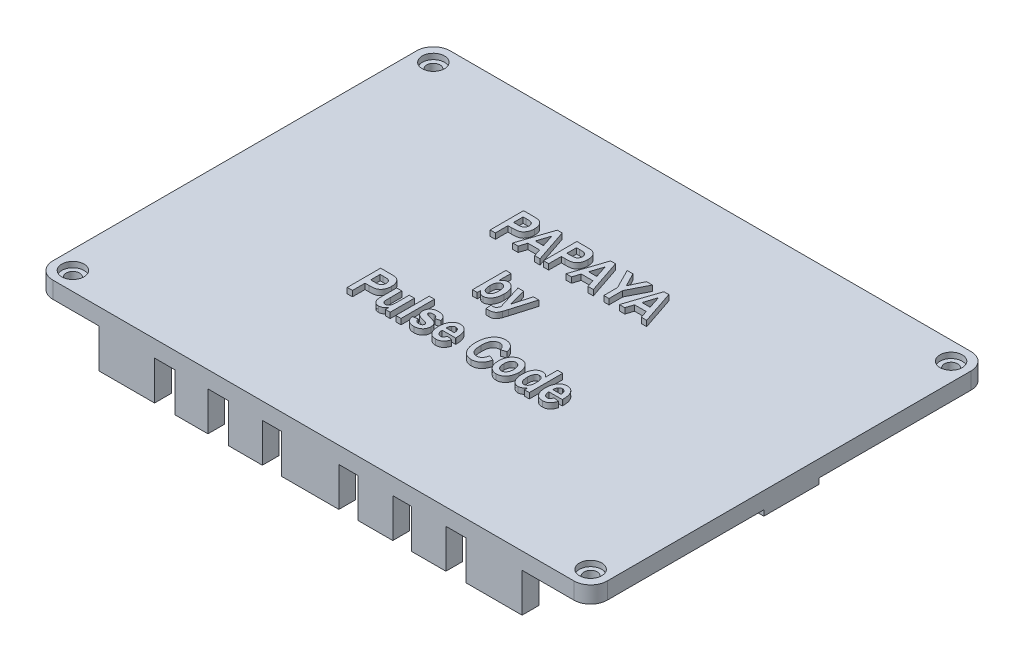
from build123d import *

# Parameters (mm, degrees)
BOSS_EXTRUDE1_DEPTH = 3
SKETCH2_W           = 9.99
SKETCH2_H           = 3
SKETCH2_W_2         = 5.89
SKETCH2_W_3         = 6.05
SKETCH2_W_4         = 10.29
SKETCH2_W_5         = 6.26
SKETCH2_W_6         = 6.2
SKETCH2_W_7         = 10.08
SKETCH2_W_8         = 5.9
SKETCH2_W_9         = 7.99
SKETCH2_W_10        = 7.85
SKETCH2_W_11        = 7.92
SKETCH2_W_12        = 6.08
BOSS_EXTRUDE2_DEPTH = 10
SKETCH3_W           = 3
SKETCH3_H           = 9.91
BOSS_EXTRUDE3_DEPTH = 4
FILLET1_R           = 3
SKETCH4_W           = 0.935064935
SKETCH4_H           = 6
BOSS_EXTRUDE4_DEPTH = 1
CUT_EXTRUDE1_REACH  = 65.515
SKETCH6_R           = 1.2
SKETCH7_R           = 2
CUT_EXTRUDE2_DEPTH  = 1


with BuildPart() as part:
    # Sketch1 → Boss-Extrude1 (new body)
    with BuildSketch(Plane(origin=(0, 0, 0), x_dir=(1, 0, 0), z_dir=(0, 1, 0))):
        Polygon((-48.075, 35.695), (-51.575, 35.695), (-51.575, -35.695), (-48.075, -35.695), (48.075, -35.695), (48.075, 35.695), align=None)
    extrude(amount=BOSS_EXTRUDE1_DEPTH)

    # Sketch2 → Boss-Extrude2 (add)
    with BuildSketch(Plane(origin=(0, 3, 0), x_dir=(1, 0, 0), z_dir=(0, 1, 0))):
        with Locations((-35.29, -34.195)):
            Rectangle(SKETCH2_W, SKETCH2_H)
        with Locations((-23.65, -34.195)):
            Rectangle(SKETCH2_W_2, SKETCH2_H)
        with Locations((-13.95, -34.195)):
            Rectangle(SKETCH2_W_3, SKETCH2_H)
        with Locations((-2.32, -34.195)):
            Rectangle(SKETCH2_W_4, SKETCH2_H)
        with Locations((9.385, -34.195)):
            Rectangle(SKETCH2_W_5, SKETCH2_H)
        with Locations((18.965, -34.195)):
            Rectangle(SKETCH2_W_6, SKETCH2_H)
        with Locations((30.715, -34.195)):
            Rectangle(SKETCH2_W_7, SKETCH2_H)
        with Locations((-37.295, 34.195)):
            Rectangle(SKETCH2_W_8, SKETCH2_H)
        with Locations((-26.67, 34.195)):
            Rectangle(SKETCH2_W_9, SKETCH2_H)
        with Locations((-14.84, 34.195)):
            Rectangle(SKETCH2_W_9, SKETCH2_H)
        with Locations((-3.14, 34.195)):
            Rectangle(SKETCH2_W_10, SKETCH2_H)
        with Locations((8.515, 34.195)):
            Rectangle(SKETCH2_W_11, SKETCH2_H)
        with Locations((19.425, 34.195)):
            Rectangle(SKETCH2_W_12, SKETCH2_H)
    extrude(amount=-BOSS_EXTRUDE2_DEPTH)

    # Sketch3 → Boss-Extrude3 (add)
    with BuildSketch(Plane(origin=(0, 3, 0), x_dir=(1, 0, 0), z_dir=(0, 1, 0))):
        with Locations((46.575, 0.4)):
            Rectangle(SKETCH3_W, SKETCH3_H)
    extrude(amount=-BOSS_EXTRUDE3_DEPTH)

    # Fillet1
    fillet1_edges = [part.edges().sort_by_distance(p)[0] for p in [
        (48.075, 1.5, 35.695),
        (-51.575, 1.5, 35.695),
        (-51.575, 1.5, -35.695),
        (48.075, 1.5, -35.695),
    ]]
    fillet(fillet1_edges, radius=FILLET1_R)

    # Sketch4 → Boss-Extrude4 (add)
    # profile 1 of 17: a face of its own
    with BuildSketch(Plane(origin=(0, 3, 0), x_dir=(1, 0, 0), z_dir=(0, 1, 0))):
        with BuildLine():
            Line((-16.083200543, 10.409135084), (-16.083200543, 16.409135084))
            Line((-16.083200543, 16.409135084), (-14.466317427, 16.409135084))
            add(Edge.make_bspline(
                [(-14.466317427, 16.409135084), (-14.394482627, 16.408881813), (-14.256890501, 16.408396698), (-14.060407268, 16.405305856), (-13.883035559, 16.397739016), (-13.725516192, 16.388359689), (-13.587410722, 16.376519438), (-13.469278625, 16.361864389), (-13.369998264, 16.346473619), (-13.311582969, 16.33006844), (-13.285310933, 16.322690278)],
                knots=[0, 0, 0, 0, 1.45237712, 2.781878126, 3.972677768, 5.041396282, 5.972228918, 6.774219171, 7.448710173, 8, 8, 8, 8], degree=3))
            add(Edge.make_bspline(
                [(-13.285310933, 16.322690278), (-13.248947113, 16.309916534), (-13.176594733, 16.284500864), (-13.072005238, 16.235158294), (-12.972436755, 16.1757252), (-12.878142428, 16.105610584), (-12.789039906, 16.026057006), (-12.704378428, 15.936721971), (-12.625998553, 15.836598108), (-12.551202917, 15.728075734), (-12.483308842, 15.61078362), (-12.424346799, 15.484582843), (-12.376393105, 15.349650734), (-12.334338713, 15.207258929), (-12.303086957, 15.056144597), (-12.281583423, 14.89705311), (-12.267898739, 14.729989717), (-12.265993652, 14.615736949), (-12.265018725, 14.5572682)],
                knots=[0, 0, 0, 0, 0.846149961, 1.683567978, 2.535100776, 3.389102938, 4.260422696, 5.155850399, 6.088615247, 7.050446182, 8.048882284, 9.061856799, 10.105243332, 11.191356413, 12.320760927, 13.490669576, 14.715852464, 16, 16, 16, 16], degree=3))
            add(Edge.make_bspline(
                [(-12.265018725, 14.5572682), (-12.265578494, 14.504075485), (-12.266678218, 14.399572885), (-12.279493052, 14.24638769), (-12.298468955, 14.099524809), (-12.326244139, 13.959506131), (-12.36313817, 13.826264071), (-12.407018242, 13.699378144), (-12.457589325, 13.57840299), (-12.517707497, 13.465378982), (-12.583260441, 13.359940489), (-12.652941603, 13.261725109), (-12.726548879, 13.172140565), (-12.804678011, 13.090817105), (-12.885167997, 13.015927111), (-12.972541827, 12.952241878), (-13.061564655, 12.893836685), (-13.157542286, 12.843827693), (-13.264691745, 12.802368955), (-13.386240198, 12.765553935), (-13.52517124, 12.735864123), (-13.681366908, 12.712113031), (-13.854813593, 12.692829311), (-14.045251483, 12.678376566), (-14.253170522, 12.669856628), (-14.397315599, 12.669211441), (-14.472405089, 12.668875343)],
                knots=[0, 0, 0, 0, 1.135396723, 2.23060449, 3.279591759, 4.295786631, 5.275377901, 6.228987074, 7.160814112, 8.071657328, 8.958908755, 9.810053931, 10.641024385, 11.43162038, 12.216736813, 12.984447025, 13.736746148, 14.488596033, 15.289898233, 16.186242141, 17.197511819, 18.320073528, 19.558272269, 20.922626145, 22.396903763, 24, 24, 24, 24], degree=3))
            Line((-14.472405089, 12.668875343), (-15.148135608, 12.668875343))
            Line((-15.148135608, 12.668875343), (-15.148135608, 10.409135084))
            Line((-15.148135608, 10.409135084), (-16.083200543, 10.409135084))
        make_face()
        with BuildLine():
            Line((-15.148135608, 15.396148071), (-15.148135608, 13.681862356))
            Line((-15.148135608, 13.681862356), (-14.538151842, 13.681862356))
            add(Edge.make_bspline(
                [(-14.538151842, 13.681862356), (-14.489042186, 13.682074921), (-14.394866612, 13.682482547), (-14.259689688, 13.68612937), (-14.136672337, 13.69203296), (-14.025820136, 13.700430148), (-13.927481315, 13.710997791), (-13.841355192, 13.724456114), (-13.767572526, 13.73954869), (-13.686101628, 13.763608825), (-13.596772778, 13.804835308), (-13.500008637, 13.868140923), (-13.413525151, 13.947690393), (-13.337885907, 14.041686108), (-13.27545465, 14.149716592), (-13.23202784, 14.270998173), (-13.204101774, 14.402994325), (-13.201454098, 14.495023508), (-13.20008366, 14.542657811)],
                knots=[0, 0, 0, 0, 1.284283312, 2.462817476, 3.536098701, 4.504784959, 5.369772942, 6.121838585, 6.783804212, 7.337847747, 8.3400838, 9.343892165, 10.350558075, 11.399797468, 12.488501389, 13.596588458, 14.755994231, 16, 16, 16, 16], degree=3))
            add(Edge.make_bspline(
                [(-13.20008366, 14.542657811), (-13.2013387, 14.591125716), (-13.203766601, 14.684887873), (-13.233271974, 14.818798402), (-13.277318475, 14.94190242), (-13.34332887, 15.049604883), (-13.419230588, 15.144404031), (-13.50495462, 15.224387963), (-13.601618563, 15.283920108), (-13.689570608, 15.322178976), (-13.77033295, 15.344865317), (-13.846787543, 15.357101152), (-13.937734571, 15.369117495), (-14.043625077, 15.380476069), (-14.164307561, 15.387076999), (-14.299897385, 15.391591074), (-14.450467176, 15.395625886), (-14.556005907, 15.395968749), (-14.61120379, 15.396148071)],
                knots=[0, 0, 0, 0, 1.217310155, 2.3549115, 3.434183208, 4.491984437, 5.51587148, 6.484436833, 7.425091316, 8.358344432, 8.888574254, 9.53159621, 10.304262475, 11.197434113, 12.210261746, 13.34451227, 14.611151563, 16, 16, 16, 16], degree=3))
            Line((-14.61120379, 15.396148071), (-15.148135608, 15.396148071))
        make_face(mode=Mode.SUBTRACT)
    # profile 2 of 17: a face of its own
    with BuildSketch(Plane(origin=(0, 3, 0), x_dir=(1, 0, 0), z_dir=(0, 1, 0))):
        Polygon((-7.122161582, 10.409135084), (-8.097405089, 10.409135084), (-8.524758985, 11.733810408), (-10.625002491, 11.733810408), (-11.052356388, 10.409135084), (-12.031252491, 10.409135084), (-10.019888855, 16.409135084), (-9.139612881, 16.409135084), align=None)
        Polygon((-8.851057686, 12.746797421), (-9.576707037, 14.995579889), (-10.299921323, 12.746797421), align=None, mode=Mode.SUBTRACT)
    # profile 3 of 17: a face of its own
    with BuildSketch(Plane(origin=(0, 3, 0), x_dir=(1, 0, 0), z_dir=(0, 1, 0))):
        with BuildLine():
            Line((-6.498784959, 10.409135084), (-6.498784959, 16.409135084))
            Line((-6.498784959, 16.409135084), (-4.881901842, 16.409135084))
            add(Edge.make_bspline(
                [(-4.881901842, 16.409135084), (-4.810067043, 16.408881813), (-4.672474916, 16.408396698), (-4.475991683, 16.405305856), (-4.298619974, 16.397739016), (-4.141100607, 16.388359689), (-4.002995138, 16.376519438), (-3.88486304, 16.361864389), (-3.78558268, 16.346473619), (-3.727167385, 16.33006844), (-3.700895349, 16.322690278)],
                knots=[0, 0, 0, 0, 1.45237712, 2.781878126, 3.972677768, 5.041396282, 5.972228918, 6.774219171, 7.448710173, 8, 8, 8, 8], degree=3))
            add(Edge.make_bspline(
                [(-3.700895349, 16.322690278), (-3.664531528, 16.309916534), (-3.592179149, 16.284500864), (-3.487589653, 16.235158294), (-3.388021171, 16.1757252), (-3.293726844, 16.105610584), (-3.204624322, 16.026057006), (-3.119962843, 15.936721971), (-3.041582968, 15.836598108), (-2.966787333, 15.728075734), (-2.898893258, 15.61078362), (-2.839931215, 15.484582843), (-2.79197752, 15.349650734), (-2.749923128, 15.207258929), (-2.718671373, 15.056144597), (-2.697167838, 14.89705311), (-2.683483155, 14.729989717), (-2.681578068, 14.615736949), (-2.680603141, 14.5572682)],
                knots=[0, 0, 0, 0, 0.846149961, 1.683567978, 2.535100776, 3.389102938, 4.260422696, 5.155850399, 6.088615247, 7.050446182, 8.048882284, 9.061856799, 10.105243332, 11.191356413, 12.320760927, 13.490669576, 14.715852464, 16, 16, 16, 16], degree=3))
            add(Edge.make_bspline(
                [(-2.680603141, 14.5572682), (-2.68116291, 14.504075485), (-2.682262633, 14.399572885), (-2.695077467, 14.24638769), (-2.714053371, 14.099524809), (-2.741828555, 13.959506131), (-2.778722585, 13.826264071), (-2.822602658, 13.699378144), (-2.873173741, 13.57840299), (-2.933291913, 13.465378982), (-2.998844856, 13.359940489), (-3.068526019, 13.261725109), (-3.142133294, 13.172140565), (-3.220262426, 13.090817105), (-3.300752412, 13.015927111), (-3.388126242, 12.952241878), (-3.47714907, 12.893836685), (-3.573126702, 12.843827693), (-3.680276161, 12.802368955), (-3.801824613, 12.765553935), (-3.940755655, 12.735864123), (-4.096951323, 12.712113031), (-4.270398008, 12.692829311), (-4.460835899, 12.678376566), (-4.668754937, 12.669856628), (-4.812900015, 12.669211441), (-4.887989504, 12.668875343)],
                knots=[0, 0, 0, 0, 1.135396723, 2.23060449, 3.279591759, 4.295786631, 5.275377901, 6.228987074, 7.160814112, 8.071657328, 8.958908755, 9.810053931, 10.641024385, 11.43162038, 12.216736813, 12.984447025, 13.736746148, 14.488596033, 15.289898233, 16.186242141, 17.197511819, 18.320073528, 19.558272269, 20.922626145, 22.396903763, 24, 24, 24, 24], degree=3))
            Line((-4.887989504, 12.668875343), (-5.563720024, 12.668875343))
            Line((-5.563720024, 12.668875343), (-5.563720024, 10.409135084))
            Line((-5.563720024, 10.409135084), (-6.498784959, 10.409135084))
        make_face()
        with BuildLine():
            Line((-5.563720024, 15.396148071), (-5.563720024, 13.681862356))
            Line((-5.563720024, 13.681862356), (-4.953736258, 13.681862356))
            add(Edge.make_bspline(
                [(-4.953736258, 13.681862356), (-4.904626602, 13.682074921), (-4.810451027, 13.682482547), (-4.675274104, 13.68612937), (-4.552256753, 13.69203296), (-4.441404551, 13.700430148), (-4.343065731, 13.710997791), (-4.256939607, 13.724456114), (-4.183156942, 13.73954869), (-4.101686044, 13.763608825), (-4.012357194, 13.804835308), (-3.915593053, 13.868140923), (-3.829109567, 13.947690393), (-3.753470323, 14.041686108), (-3.691039066, 14.149716592), (-3.647612255, 14.270998173), (-3.619686189, 14.402994325), (-3.617038513, 14.495023508), (-3.615668076, 14.542657811)],
                knots=[0, 0, 0, 0, 1.284283312, 2.462817476, 3.536098701, 4.504784959, 5.369772942, 6.121838585, 6.783804212, 7.337847747, 8.3400838, 9.343892165, 10.350558075, 11.399797468, 12.488501389, 13.596588458, 14.755994231, 16, 16, 16, 16], degree=3))
            add(Edge.make_bspline(
                [(-3.615668076, 14.542657811), (-3.616923116, 14.591125716), (-3.619351017, 14.684887873), (-3.64885639, 14.818798402), (-3.692902891, 14.94190242), (-3.758913286, 15.049604883), (-3.834815004, 15.144404031), (-3.920539035, 15.224387963), (-4.017202979, 15.283920108), (-4.105155024, 15.322178976), (-4.185917366, 15.344865317), (-4.262371959, 15.357101152), (-4.353318987, 15.369117495), (-4.459209493, 15.380476069), (-4.579891976, 15.387076999), (-4.7154818, 15.391591074), (-4.866051591, 15.395625886), (-4.971590323, 15.395968749), (-5.026788206, 15.396148071)],
                knots=[0, 0, 0, 0, 1.217310155, 2.3549115, 3.434183208, 4.491984437, 5.51587148, 6.484436833, 7.425091316, 8.358344432, 8.888574254, 9.53159621, 10.304262475, 11.197434113, 12.210261746, 13.34451227, 14.611151563, 16, 16, 16, 16], degree=3))
            Line((-5.026788206, 15.396148071), (-5.563720024, 15.396148071))
        make_face(mode=Mode.SUBTRACT)
    # profile 4 of 17: a face of its own
    with BuildSketch(Plane(origin=(0, 3, 0), x_dir=(1, 0, 0), z_dir=(0, 1, 0))):
        Polygon((2.462254002, 10.409135084), (1.487010496, 10.409135084), (1.059656599, 11.733810408), (-1.040586907, 11.733810408), (-1.467940803, 10.409135084), (-2.446836907, 10.409135084), (-0.435473271, 16.409135084), (0.444802703, 16.409135084), align=None)
        Polygon((0.733357898, 12.746797421), (0.007708547, 14.995579889), (-0.715505738, 12.746797421), align=None, mode=Mode.SUBTRACT)
    # profile 5 of 17: a face of its own
    with BuildSketch(Plane(origin=(0, 3, 0), x_dir=(1, 0, 0), z_dir=(0, 1, 0))):
        Polygon((4.332383872, 10.409135084), (4.332383872, 12.881943525), (2.54017608, 16.409135084), (3.58116634, 16.409135084), (4.844965041, 13.960677291), (6.01866634, 16.409135084), (7.059656599, 16.409135084), (5.267448807, 12.87463833), (5.267448807, 10.409135084), align=None)
    # profile 6 of 17: a face of its own
    with BuildSketch(Plane(origin=(0, 3, 0), x_dir=(1, 0, 0), z_dir=(0, 1, 0))):
        Polygon((12.046669586, 10.409135084), (11.07142608, 10.409135084), (10.644072184, 11.733810408), (8.543828677, 11.733810408), (8.116474781, 10.409135084), (7.137578677, 10.409135084), (9.148942314, 16.409135084), (10.029218288, 16.409135084), align=None)
        Polygon((10.317773483, 12.746797421), (9.592124132, 14.995579889), (8.868909846, 12.746797421), align=None, mode=Mode.SUBTRACT)
    # profile 7 of 17: a face of its own
    with BuildSketch(Plane(origin=(0, 3, 0), x_dir=(1, 0, 0), z_dir=(0, 1, 0))):
        with BuildLine():
            Line((-8.368914829, -0.486968813), (-8.368914829, 5.513031187))
            Line((-8.368914829, 5.513031187), (-7.433849894, 5.513031187))
            Line((-7.433849894, 5.513031187), (-7.433849894, 3.347040928))
            add(Edge.make_bspline(
                [(-7.433849894, 3.347040928), (-7.396945539, 3.395215682), (-7.325285119, 3.488760824), (-7.207219714, 3.61348419), (-7.083021041, 3.718434165), (-6.953407069, 3.804120064), (-6.818829814, 3.872129987), (-6.678374404, 3.920133131), (-6.532817131, 3.948695228), (-6.433973724, 3.952619135), (-6.384336907, 3.954589629)],
                knots=[0, 0, 0, 0, 1.153915022, 2.240657901, 3.25983707, 4.240567445, 5.190077079, 6.120306609, 7.056062525, 8, 8, 8, 8], degree=3))
            add(Edge.make_bspline(
                [(-6.384336907, 3.954589629), (-6.332268834, 3.953085242), (-6.22904852, 3.950102929), (-6.077820642, 3.922265788), (-5.932189329, 3.878230266), (-5.792850546, 3.816029395), (-5.66058998, 3.734479971), (-5.534621536, 3.635908857), (-5.413461741, 3.521302582), (-5.300559643, 3.388183343), (-5.196604206, 3.238380533), (-5.106286793, 3.070597199), (-5.03143711, 2.885724542), (-4.969143589, 2.684540424), (-4.920812131, 2.466690617), (-4.887609954, 2.232203164), (-4.866469397, 1.981355966), (-4.86380072, 1.808530684), (-4.862421323, 1.719200019)],
                knots=[0, 0, 0, 0, 0.826172328, 1.637813013, 2.432908967, 3.237791964, 4.053516401, 4.894043283, 5.773876227, 6.697311994, 7.660896571, 8.664410284, 9.716420796, 10.823302327, 12.005381772, 13.255880263, 14.581607741, 16, 16, 16, 16], degree=3))
            add(Edge.make_bspline(
                [(-4.862421323, 1.719200019), (-4.863848167, 1.630279704), (-4.866621215, 1.457464601), (-4.887359529, 1.205703989), (-4.921978744, 0.969632634), (-4.971654486, 0.749265129), (-5.036257892, 0.545287741), (-5.11415495, 0.356288466), (-5.206315826, 0.183050514), (-5.312592508, 0.027045438), (-5.428125228, -0.111081592), (-5.548344467, -0.232684587), (-5.674634993, -0.334659537), (-5.806140455, -0.418409194), (-5.942343976, -0.484654776), (-6.084292595, -0.53179176), (-6.231125298, -0.558671125), (-6.330660869, -0.562810547), (-6.38068431, -0.564890891)],
                knots=[0, 0, 0, 0, 1.400709689, 2.722255195, 3.976382686, 5.15669585, 6.276897292, 7.343142756, 8.372879173, 9.362391124, 10.311158198, 11.206298846, 12.052035771, 12.862603966, 13.65756498, 14.43192218, 15.21193352, 16, 16, 16, 16], degree=3))
            add(Edge.make_bspline(
                [(-6.38068431, -0.564890891), (-6.43283378, -0.562915718), (-6.537440622, -0.558953711), (-6.693236277, -0.522038488), (-6.847960793, -0.466274658), (-7.000546733, -0.38797137), (-7.147085689, -0.287408532), (-7.281218399, -0.161058066), (-7.405973309, -0.01408919), (-7.475797779, 0.097288179), (-7.511771972, 0.154670798)],
                knots=[0, 0, 0, 0, 0.890811718, 1.786882985, 2.724611209, 3.699532422, 4.712470003, 5.753911583, 6.842795126, 8, 8, 8, 8], degree=3))
            Line((-7.511771972, 0.154670798), (-7.511771972, -0.486968813))
            Line((-7.511771972, -0.486968813), (-8.368914829, -0.486968813))
        make_face()
        with BuildLine():
            add(Edge.make_bspline(
                [(-7.443590154, 1.776424045), (-7.443615595, 1.730146944), (-7.44366494, 1.640388594), (-7.436662531, 1.510116776), (-7.428892936, 1.388644456), (-7.416604191, 1.275314626), (-7.400690505, 1.170626912), (-7.383391734, 1.073519568), (-7.359623586, 0.986043098), (-7.326725847, 0.881669257), (-7.274715238, 0.765598935), (-7.202241608, 0.640569139), (-7.11579758, 0.534823626), (-7.019876189, 0.446226366), (-6.915251908, 0.378878395), (-6.80782204, 0.328574154), (-6.696895614, 0.297943092), (-6.621531969, 0.294143561), (-6.584012232, 0.292251967)],
                knots=[0, 0, 0, 0, 1.161162798, 2.252173414, 3.273190422, 4.215752327, 5.111706747, 5.930717123, 6.689159043, 7.384894154, 8.675530102, 9.872069028, 11.001483844, 12.090162374, 13.135428747, 14.110715982, 15.059421279, 16, 16, 16, 16], degree=3))
            add(Edge.make_bspline(
                [(-6.584012232, 0.292251967), (-6.557139637, 0.293045234), (-6.504123479, 0.294610248), (-6.426780837, 0.311354263), (-6.352242749, 0.33728402), (-6.28083625, 0.373552512), (-6.212654452, 0.421328002), (-6.147264562, 0.47836093), (-6.084597498, 0.545950748), (-6.026506963, 0.624647702), (-5.970625332, 0.713021779), (-5.925291568, 0.815652013), (-5.885160437, 0.928713689), (-5.851842535, 1.054011786), (-5.828908775, 1.191507124), (-5.810179928, 1.340933089), (-5.79947802, 1.502323797), (-5.798164062, 1.614071385), (-5.797486258, 1.671716252)],
                knots=[0, 0, 0, 0, 0.730671078, 1.44151963, 2.143987178, 2.875409932, 3.614142111, 4.405237358, 5.234098356, 6.118138175, 7.065778762, 8.074526401, 9.165003942, 10.330975468, 11.599089299, 12.95740181, 14.430479167, 16, 16, 16, 16], degree=3))
            add(Edge.make_bspline(
                [(-5.797486258, 1.671716252), (-5.798123523, 1.732610795), (-5.799348199, 1.849636107), (-5.810423142, 2.018682606), (-5.828393369, 2.174783919), (-5.853319814, 2.318082935), (-5.886260915, 2.448355059), (-5.926003488, 2.565474641), (-5.973074621, 2.669941049), (-6.028815842, 2.760513968), (-6.08834141, 2.840406619), (-6.153048032, 2.908920632), (-6.221900306, 2.966612209), (-6.293793497, 3.014819342), (-6.370555336, 3.051709561), (-6.451046323, 3.078618788), (-6.535864623, 3.095008917), (-6.593680178, 3.096626964), (-6.622973271, 3.097446772)],
                knots=[0, 0, 0, 0, 1.588470091, 3.052674342, 4.417171652, 5.68614867, 6.84427862, 7.919071892, 8.909232576, 9.826213971, 10.688053992, 11.504404882, 12.278465187, 13.027277169, 13.756521869, 14.493108144, 15.236511301, 16, 16, 16, 16], degree=3))
            add(Edge.make_bspline(
                [(-6.622973271, 3.097446772), (-6.651063098, 3.09666359), (-6.706491808, 3.095118163), (-6.787784743, 3.078147653), (-6.86598975, 3.052849236), (-6.940814023, 3.01711249), (-7.012389483, 2.971364829), (-7.080393252, 2.915120648), (-7.145375503, 2.84838294), (-7.207275558, 2.772281627), (-7.263622771, 2.685187609), (-7.312616216, 2.587339059), (-7.351855438, 2.477819076), (-7.386725534, 2.358533779), (-7.410840369, 2.227860286), (-7.431237881, 2.087041582), (-7.441485173, 1.935261156), (-7.442874671, 1.830412757), (-7.443590154, 1.776424045)],
                knots=[0, 0, 0, 0, 0.776767291, 1.532768692, 2.289771863, 3.048857806, 3.822039496, 4.636510575, 5.486867111, 6.39782016, 7.348597489, 8.353810965, 9.420593027, 10.566051315, 11.791525695, 13.096417078, 14.504882227, 16, 16, 16, 16], degree=3))
        make_face(mode=Mode.SUBTRACT)
    # profile 8 of 17: a face of its own
    with BuildSketch(Plane(origin=(0, 3, 0), x_dir=(1, 0, 0), z_dir=(0, 1, 0))):
        with BuildLine():
            Line((-4.550733011, 3.876667551), (-3.575489504, 3.876667551))
            Line((-3.575489504, 3.876667551), (-2.683038206, 0.751261707))
            Line((-2.683038206, 0.751261707), (-1.780846647, 3.876667551))
            Line((-1.780846647, 3.876667551), (-0.810473271, 3.876667551))
            Line((-0.810473271, 3.876667551), (-2.04870379, -0.322601929))
            Line((-2.04870379, -0.322601929), (-2.300733011, -1.116433098))
            add(Edge.make_bspline(
                [(-2.300733011, -1.116433098), (-2.327424118, -1.186210244), (-2.377668218, -1.317560733), (-2.461689385, -1.496235244), (-2.543780211, -1.646394859), (-2.62772905, -1.769671216), (-2.718706223, -1.870666202), (-2.81856739, -1.956873776), (-2.929820577, -2.03116984), (-3.052874466, -2.094152569), (-3.189067237, -2.142945573), (-3.339567991, -2.176468057), (-3.50429472, -2.197220798), (-3.61925532, -2.199875403), (-3.678979764, -2.201254527)],
                knots=[0, 0, 0, 0, 1.408165691, 2.650771227, 3.719542057, 4.632288496, 5.455871724, 6.27507084, 7.11338158, 7.972356977, 8.875202473, 9.833024897, 10.874210966, 12, 12, 12, 12], degree=3))
            add(Edge.make_bspline(
                [(-3.678979764, -2.201254527), (-3.773135608, -2.201254527), (-3.95982392, -2.201254527), (-4.146512232, -2.201254527), (-4.239044699, -2.201254527)],
                knots=[0, 0, 0, 0, 1.008695652, 2, 2, 2, 2], degree=3))
            Line((-4.239044699, -2.201254527), (-4.316966777, -1.110345436))
            add(Edge.make_bspline(
                [(-4.316966777, -1.110345436), (-4.281788139, -1.133998934), (-4.215535811, -1.178545837), (-4.113692699, -1.22764906), (-4.017366424, -1.259897515), (-3.953952345, -1.264157552), (-3.92370379, -1.266189592)],
                knots=[0, 0, 0, 0, 1.1836853, 2.229247979, 3.15535019, 4, 4, 4, 4], degree=3))
            add(Edge.make_bspline(
                [(-3.92370379, -1.266189592), (-3.880924628, -1.264445732), (-3.798339854, -1.261079227), (-3.680127005, -1.231546668), (-3.575185785, -1.180489978), (-3.479110314, -1.109576137), (-3.393954423, -1.009891611), (-3.31400943, -0.881893588), (-3.240385735, -0.721348368), (-3.198618709, -0.602221601), (-3.176138855, -0.538105176)],
                knots=[0, 0, 0, 0, 0.906286219, 1.74957713, 2.561772538, 3.367329072, 4.263588965, 5.32367375, 6.559547323, 8, 8, 8, 8], degree=3))
            Line((-3.176138855, -0.538105176), (-4.550733011, 3.876667551))
        make_face()
    # profile 9 of 17: a face of its own
    with BuildSketch(Plane(origin=(0, 3, 0), x_dir=(1, 0, 0), z_dir=(0, 1, 0))):
        with BuildLine():
            Line((-19.97930444, -11.383072709), (-19.97930444, -5.383072709))
            Line((-19.97930444, -5.383072709), (-18.362421323, -5.383072709))
            add(Edge.make_bspline(
                [(-18.362421323, -5.383072709), (-18.290586523, -5.38332598), (-18.152994397, -5.383811094), (-17.956511164, -5.386901937), (-17.779139455, -5.394468776), (-17.621620088, -5.403848103), (-17.483514618, -5.415688354), (-17.365382521, -5.430343403), (-17.26610216, -5.445734173), (-17.207686865, -5.462139353), (-17.181414829, -5.469517514)],
                knots=[0, 0, 0, 0, 1.45237712, 2.781878126, 3.972677768, 5.041396282, 5.972228918, 6.774219171, 7.448710173, 8, 8, 8, 8], degree=3))
            add(Edge.make_bspline(
                [(-17.181414829, -5.469517514), (-17.145051009, -5.482291259), (-17.072698629, -5.507706928), (-16.968109134, -5.557049498), (-16.868540651, -5.616482593), (-16.774246325, -5.686597208), (-16.685143802, -5.766150786), (-16.600482324, -5.855485821), (-16.522102449, -5.955609684), (-16.447306813, -6.064132058), (-16.379412739, -6.181424172), (-16.320450695, -6.307624949), (-16.272497001, -6.442557058), (-16.230442609, -6.584948863), (-16.199190853, -6.736063195), (-16.177687319, -6.895154682), (-16.164002636, -7.062218075), (-16.162097548, -7.176470843), (-16.161122621, -7.234939592)],
                knots=[0, 0, 0, 0, 0.846149961, 1.683567978, 2.535100776, 3.389102938, 4.260422696, 5.155850399, 6.088615247, 7.050446182, 8.048882284, 9.061856799, 10.105243332, 11.191356413, 12.320760927, 13.490669576, 14.715852464, 16, 16, 16, 16], degree=3))
            add(Edge.make_bspline(
                [(-16.161122621, -7.234939592), (-16.16168239, -7.288132307), (-16.162782114, -7.392634907), (-16.175596948, -7.545820102), (-16.194572852, -7.692682984), (-16.222348035, -7.832701662), (-16.259242066, -7.965943721), (-16.303122138, -8.092829648), (-16.353693221, -8.213804802), (-16.413811393, -8.32682881), (-16.479364337, -8.432267303), (-16.549045499, -8.530482683), (-16.622652775, -8.620067227), (-16.700781907, -8.701390688), (-16.781271893, -8.776280681), (-16.868645723, -8.839965914), (-16.957668551, -8.898371108), (-17.053646182, -8.948380099), (-17.160795641, -8.989838838), (-17.282344094, -9.026653858), (-17.421275136, -9.056343669), (-17.577470804, -9.080094761), (-17.750917489, -9.099378481), (-17.941355379, -9.113831226), (-18.149274418, -9.122351164), (-18.293419495, -9.122996352), (-18.368508985, -9.123332449)],
                knots=[0, 0, 0, 0, 1.135396723, 2.23060449, 3.279591759, 4.295786631, 5.275377901, 6.228987074, 7.160814112, 8.071657328, 8.958908755, 9.810053931, 10.641024385, 11.43162038, 12.216736813, 12.984447025, 13.736746148, 14.488596033, 15.289898233, 16.186242141, 17.197511819, 18.320073528, 19.558272269, 20.922626145, 22.396903763, 24, 24, 24, 24], degree=3))
            Line((-18.368508985, -9.123332449), (-19.044239504, -9.123332449))
            Line((-19.044239504, -9.123332449), (-19.044239504, -11.383072709))
            Line((-19.044239504, -11.383072709), (-19.97930444, -11.383072709))
        make_face()
        with BuildLine():
            Line((-19.044239504, -6.396059722), (-19.044239504, -8.110345436))
            Line((-19.044239504, -8.110345436), (-18.434255738, -8.110345436))
            add(Edge.make_bspline(
                [(-18.434255738, -8.110345436), (-18.385146082, -8.110132871), (-18.290970508, -8.109725245), (-18.155793584, -8.106078423), (-18.032776233, -8.100174832), (-17.921924032, -8.091777645), (-17.823585211, -8.081210001), (-17.737459088, -8.067751679), (-17.663676422, -8.052659102), (-17.582205524, -8.028598967), (-17.492876674, -7.987372484), (-17.396112533, -7.924066869), (-17.309629047, -7.844517399), (-17.233989803, -7.750521684), (-17.171558546, -7.6424912), (-17.128131736, -7.521209619), (-17.10020567, -7.389213467), (-17.097557994, -7.297184285), (-17.096187556, -7.249549981)],
                knots=[0, 0, 0, 0, 1.284283312, 2.462817476, 3.536098701, 4.504784959, 5.369772942, 6.121838585, 6.783804212, 7.337847747, 8.3400838, 9.343892165, 10.350558075, 11.399797468, 12.488501389, 13.596588458, 14.755994231, 16, 16, 16, 16], degree=3))
            add(Edge.make_bspline(
                [(-17.096187556, -7.249549981), (-17.097442596, -7.201082077), (-17.099870497, -7.107319919), (-17.129375871, -6.97340939), (-17.173422371, -6.850305372), (-17.239432767, -6.742602909), (-17.315334484, -6.647803762), (-17.401058516, -6.567819829), (-17.497722459, -6.508287684), (-17.585674504, -6.470028817), (-17.666436846, -6.447342475), (-17.74289144, -6.43510664), (-17.833838467, -6.423090298), (-17.939728973, -6.411731723), (-18.060411457, -6.405130793), (-18.196001281, -6.400616718), (-18.346571072, -6.396581906), (-18.452109803, -6.396239043), (-18.507307686, -6.396059722)],
                knots=[0, 0, 0, 0, 1.217310155, 2.3549115, 3.434183208, 4.491984437, 5.51587148, 6.484436833, 7.425091316, 8.358344432, 8.888574254, 9.53159621, 10.304262475, 11.197434113, 12.210261746, 13.34451227, 14.611151563, 16, 16, 16, 16], degree=3))
            Line((-18.507307686, -6.396059722), (-19.044239504, -6.396059722))
        make_face(mode=Mode.SUBTRACT)
    # profile 10 of 17: a face of its own
    with BuildSketch(Plane(origin=(0, 3, 0), x_dir=(1, 0, 0), z_dir=(0, 1, 0))):
        with BuildLine():
            Line((-13.122161582, -11.383072709), (-13.122161582, -10.728040241))
            add(Edge.make_bspline(
                [(-13.122161582, -10.728040241), (-13.155684096, -10.783375839), (-13.221500694, -10.892019265), (-13.342888764, -11.036938485), (-13.478888759, -11.163680236), (-13.629183517, -11.269677561), (-13.787822373, -11.355778051), (-13.952613768, -11.415073554), (-14.120331597, -11.454236732), (-14.233958442, -11.458736271), (-14.290992751, -11.460994787)],
                knots=[0, 0, 0, 0, 1.073181246, 2.107035854, 3.127667403, 4.152518751, 5.153623586, 6.115288675, 7.05398053, 8, 8, 8, 8], degree=3))
            add(Edge.make_bspline(
                [(-14.290992751, -11.460994787), (-14.347608083, -11.459184863), (-14.459154811, -11.455618849), (-14.621094399, -11.418501375), (-14.774219223, -11.360962538), (-14.91706123, -11.280947958), (-15.044896456, -11.177397889), (-15.15922242, -11.056142845), (-15.252271069, -10.912648555), (-15.317086178, -10.77980441), (-15.357861575, -10.661534771), (-15.38642518, -10.562157088), (-15.408915542, -10.45301562), (-15.426919691, -10.334284491), (-15.441336555, -10.206339351), (-15.452498261, -10.068713209), (-15.458172255, -9.921269668), (-15.459261875, -9.81976497), (-15.45982392, -9.767407124)],
                knots=[0, 0, 0, 0, 1.162261238, 2.28995283, 3.396453524, 4.517333078, 5.639330159, 6.767021751, 7.928773692, 9.141688372, 9.79615675, 10.498749432, 11.266272349, 12.085272204, 12.967107849, 13.912979192, 14.923479254, 16, 16, 16, 16], degree=3))
            Line((-15.45982392, -9.767407124), (-15.45982392, -7.019436345))
            Line((-15.45982392, -7.019436345), (-14.524758985, -7.019436345))
            Line((-14.524758985, -7.019436345), (-14.524758985, -9.025929852))
            add(Edge.make_bspline(
                [(-14.524758985, -9.025929852), (-14.524299348, -9.094111088), (-14.523423847, -9.223980351), (-14.523010574, -9.409065426), (-14.519220968, -9.574661068), (-14.513875648, -9.720734389), (-14.510031003, -9.847455696), (-14.502524769, -9.954610116), (-14.494355086, -10.042349419), (-14.48241109, -10.131624659), (-14.458725846, -10.224428938), (-14.418396983, -10.322241438), (-14.365912469, -10.407834161), (-14.299875188, -10.479380735), (-14.222166808, -10.533558538), (-14.138168191, -10.575716903), (-14.045403136, -10.598455357), (-13.981442184, -10.602030876), (-13.948866128, -10.603851929)],
                knots=[0, 0, 0, 0, 1.737551809, 3.309628665, 4.716535477, 5.958311227, 7.034714757, 7.946957855, 8.695120732, 9.280174494, 10.240903764, 11.126371569, 11.967227356, 12.786824826, 13.587542025, 14.369265043, 15.169447717, 16, 16, 16, 16], degree=3))
            add(Edge.make_bspline(
                [(-13.948866128, -10.603851929), (-13.910530619, -10.601567112), (-13.834274564, -10.597022209), (-13.722325249, -10.565603648), (-13.616828087, -10.511667596), (-13.517372483, -10.439916656), (-13.427919618, -10.35218514), (-13.353800722, -10.249692454), (-13.297588586, -10.13513156), (-13.264421144, -10.028609298), (-13.245606828, -9.92936165), (-13.234361587, -9.834117738), (-13.223085575, -9.719689716), (-13.215385955, -9.585635288), (-13.207719431, -9.432247036), (-13.203140441, -9.259315059), (-13.201038909, -9.066925721), (-13.200412139, -8.932180378), (-13.20008366, -8.861562968)],
                knots=[0, 0, 0, 0, 0.864008729, 1.718664964, 2.598420898, 3.52272579, 4.473814732, 5.410892836, 6.360219685, 7.338343567, 7.916155255, 8.635676277, 9.499685007, 10.50819223, 11.662365819, 12.962144257, 14.407918971, 16, 16, 16, 16], degree=3))
            Line((-13.20008366, -8.861562968), (-13.20008366, -7.019436345))
            Line((-13.20008366, -7.019436345), (-12.265018725, -7.019436345))
            Line((-12.265018725, -7.019436345), (-12.265018725, -11.383072709))
            Line((-12.265018725, -11.383072709), (-13.122161582, -11.383072709))
        make_face()
    # profile 11 of 17: a face of its own
    with BuildSketch(Plane(origin=(0, 3, 0), x_dir=(1, 0, 0), z_dir=(0, 1, 0))):
        with Locations((-10.784499245, -8.383072709)):
            Rectangle(SKETCH4_W, SKETCH4_H)
    # profile 12 of 17: a face of its own
    with BuildSketch(Plane(origin=(0, 3, 0), x_dir=(1, 0, 0), z_dir=(0, 1, 0))):
        with BuildLine():
            Line((-9.615668076, -10.082748033), (-8.680603141, -9.902553228))
            add(Edge.make_bspline(
                [(-8.680603141, -9.902553228), (-8.669551796, -9.957744995), (-8.648527287, -10.062743958), (-8.594576932, -10.206991751), (-8.525228405, -10.330052058), (-8.438721915, -10.430591156), (-8.33645597, -10.510025571), (-8.217246434, -10.56454142), (-8.082626356, -10.598499564), (-7.987639311, -10.60201264), (-7.937908336, -10.603851929)],
                knots=[0, 0, 0, 0, 1.194221061, 2.271932566, 3.256845322, 4.179849703, 5.071392693, 5.985495368, 6.945295336, 8, 8, 8, 8], degree=3))
            add(Edge.make_bspline(
                [(-7.937908336, -10.603851929), (-7.885853846, -10.602344634), (-7.788399469, -10.599522735), (-7.652317025, -10.575727892), (-7.536426726, -10.53508437), (-7.441948954, -10.475880786), (-7.369044053, -10.403185231), (-7.315997549, -10.32024007), (-7.28252265, -10.22685013), (-7.279535878, -10.160546781), (-7.278005738, -10.126579202)],
                knots=[0, 0, 0, 0, 1.361317969, 2.548606181, 3.600144125, 4.554712034, 5.440782291, 6.271544745, 7.114502653, 8, 8, 8, 8], degree=3))
            add(Edge.make_bspline(
                [(-7.278005738, -10.126579202), (-7.27883076, -10.103354254), (-7.28039821, -10.059229421), (-7.295197345, -9.996729063), (-7.320409348, -9.941783572), (-7.345866224, -9.91220371), (-7.358362881, -9.897683098)],
                knots=[0, 0, 0, 0, 1.118612769, 2.125240534, 3.079689628, 4, 4, 4, 4], degree=3))
            add(Edge.make_bspline(
                [(-7.358362881, -9.897683098), (-7.373398597, -9.88419045), (-7.404058598, -9.856676987), (-7.45899117, -9.823844044), (-7.521615172, -9.796740039), (-7.567171585, -9.784659981), (-7.590911582, -9.778364916)],
                knots=[0, 0, 0, 0, 0.914538409, 1.864876155, 2.88736118, 4, 4, 4, 4], degree=3))
            add(Edge.make_bspline(
                [(-7.590911582, -9.778364916), (-7.689680956, -9.753767919), (-7.878091389, -9.706847191), (-8.144645754, -9.631079464), (-8.382368624, -9.557388359), (-8.591135976, -9.484400941), (-8.771612194, -9.41352078), (-8.922926813, -9.343070481), (-9.047386508, -9.275455117), (-9.114991636, -9.222757013), (-9.145700543, -9.198819462)],
                knots=[0, 0, 0, 0, 1.463306405, 2.791373318, 3.983552551, 5.040959851, 5.970616761, 6.769381549, 7.441004715, 8, 8, 8, 8], degree=3))
            add(Edge.make_bspline(
                [(-9.145700543, -9.198819462), (-9.176759287, -9.169392834), (-9.238390339, -9.11100045), (-9.319425449, -9.013181371), (-9.386492728, -8.90638044), (-9.441510677, -8.791879408), (-9.486069477, -8.66979262), (-9.515624482, -8.538839354), (-9.53449081, -8.400670178), (-9.536645181, -8.306026746), (-9.537745998, -8.257666865)],
                knots=[0, 0, 0, 0, 0.974918336, 1.93456771, 2.886962852, 3.842947211, 4.826390971, 5.843137675, 6.897909738, 8, 8, 8, 8], degree=3))
            add(Edge.make_bspline(
                [(-9.537745998, -8.257666865), (-9.536659276, -8.208901857), (-9.534541141, -8.113853817), (-9.515591588, -7.974865739), (-9.485749281, -7.84337885), (-9.442770671, -7.719300535), (-9.387748007, -7.602896499), (-9.320373787, -7.493838765), (-9.240582774, -7.392345155), (-9.149371141, -7.298134853), (-9.045605645, -7.214508629), (-8.931243163, -7.140449065), (-8.805738649, -7.078586914), (-8.668719076, -7.02884877), (-8.521481691, -6.988384343), (-8.362887066, -6.960890841), (-8.193496324, -6.94535637), (-8.077145623, -6.942822874), (-8.017047946, -6.941514267)],
                knots=[0, 0, 0, 0, 1.026502205, 2.000758919, 2.948217531, 3.861802795, 4.760230456, 5.654420228, 6.555445915, 7.474134155, 8.409839505, 9.355754899, 10.3380758, 11.349415399, 12.421345181, 13.549680573, 14.73435651, 16, 16, 16, 16], degree=3))
            add(Edge.make_bspline(
                [(-8.017047946, -6.941514267), (-7.959816954, -6.942691965), (-7.848471513, -6.944983229), (-7.686744325, -6.955669663), (-7.536206444, -6.980159833), (-7.395334242, -7.009295357), (-7.265762163, -7.049903091), (-7.145424349, -7.096749199), (-7.03758834, -7.155751616), (-6.938481345, -7.222032903), (-6.848117535, -7.298373355), (-6.767129547, -7.387021736), (-6.690881753, -7.484571461), (-6.62269371, -7.593654044), (-6.562040566, -7.713777758), (-6.507375452, -7.843907833), (-6.459505652, -7.985138592), (-6.434018283, -8.083781284), (-6.420862881, -8.134696085)],
                knots=[0, 0, 0, 0, 1.248084267, 2.428203468, 3.529427848, 4.570725755, 5.561476121, 6.486515433, 7.381224353, 8.235238075, 9.082671921, 9.952895212, 10.848435016, 11.778833006, 12.752285061, 13.779351126, 14.853803633, 16, 16, 16, 16], degree=3))
            Line((-6.420862881, -8.134696085), (-7.278005738, -8.34411167))
            add(Edge.make_bspline(
                [(-7.278005738, -8.34411167), (-7.289626225, -8.301029103), (-7.311947371, -8.218274202), (-7.36630415, -8.105684835), (-7.435175271, -8.010439862), (-7.518381786, -7.931270647), (-7.617570398, -7.871554185), (-7.730869333, -7.828451922), (-7.858463667, -7.803072537), (-7.948342366, -7.800168788), (-7.995132362, -7.798657124)],
                knots=[0, 0, 0, 0, 1.083259811, 2.080773411, 3.020369137, 3.927961785, 4.853774497, 5.815953851, 6.86300636, 8, 8, 8, 8], degree=3))
            add(Edge.make_bspline(
                [(-7.995132362, -7.798657124), (-8.052424933, -7.799593046), (-8.158825731, -7.801331192), (-8.304823853, -7.819358646), (-8.425869107, -7.846496002), (-8.520512234, -7.889071645), (-8.591556366, -7.942006901), (-8.643408086, -8.000638449), (-8.675497369, -8.068909921), (-8.678878901, -8.117318036), (-8.680603141, -8.14200128)],
                knots=[0, 0, 0, 0, 1.618318152, 3.005456707, 4.151618533, 5.111354884, 5.914270576, 6.63834977, 7.305696047, 8, 8, 8, 8], degree=3))
            add(Edge.make_bspline(
                [(-8.680603141, -8.14200128), (-8.678799547, -8.164292324), (-8.675237407, -8.208317664), (-8.643615481, -8.269599612), (-8.596967458, -8.325673165), (-8.554482713, -8.353682325), (-8.53206418, -8.368462319)],
                knots=[0, 0, 0, 0, 0.939106377, 1.854757316, 2.867989107, 4, 4, 4, 4], degree=3))
            add(Edge.make_bspline(
                [(-8.53206418, -8.368462319), (-8.516739301, -8.376771957), (-8.481122675, -8.396084426), (-8.41775995, -8.423665308), (-8.3369298, -8.452275653), (-8.238919757, -8.483804698), (-8.123726452, -8.518985165), (-7.991136342, -8.556881175), (-7.840594033, -8.595276747), (-7.73458372, -8.622131136), (-7.67857392, -8.636319462)],
                knots=[0, 0, 0, 0, 0.466592549, 1.084410032, 1.847487931, 2.761498575, 3.840763086, 5.072090856, 6.453059882, 8, 8, 8, 8], degree=3))
            add(Edge.make_bspline(
                [(-7.67857392, -8.636319462), (-7.615142601, -8.652920749), (-7.493342636, -8.684798318), (-7.319411149, -8.737912773), (-7.162315432, -8.796566933), (-7.020156583, -8.857873234), (-6.894957352, -8.92526241), (-6.784170559, -8.993818355), (-6.690275182, -9.068058644), (-6.638204922, -9.123519964), (-6.613233011, -9.150118163)],
                knots=[0, 0, 0, 0, 1.311952231, 2.519193035, 3.636944052, 4.66597864, 5.6141993, 6.479319727, 7.27071051, 8, 8, 8, 8], degree=3))
            add(Edge.make_bspline(
                [(-6.613233011, -9.150118163), (-6.591548539, -9.177292666), (-6.54814116, -9.231689836), (-6.493077113, -9.321600146), (-6.44734428, -9.418291977), (-6.407429285, -9.520826215), (-6.378847451, -9.630859725), (-6.358573289, -9.747350602), (-6.344250741, -9.870138838), (-6.343383637, -9.954458409), (-6.342940803, -9.997520761)],
                knots=[0, 0, 0, 0, 0.917749177, 1.837125016, 2.776963468, 3.740652584, 4.739251396, 5.773915519, 6.863129484, 8, 8, 8, 8], degree=3))
            add(Edge.make_bspline(
                [(-6.342940803, -9.997520761), (-6.343814838, -10.049554313), (-6.345529344, -10.151623355), (-6.367770475, -10.301008502), (-6.399515768, -10.443643084), (-6.446551041, -10.579023089), (-6.50656875, -10.707484277), (-6.579313788, -10.829615271), (-6.667224856, -10.943544328), (-6.766096031, -11.050164235), (-6.877215406, -11.146991089), (-6.999495113, -11.230424234), (-7.130315539, -11.303845597), (-7.273183281, -11.360424356), (-7.425647304, -11.40536766), (-7.588137106, -11.438183996), (-7.760466687, -11.457974866), (-7.87860131, -11.459971725), (-7.939125868, -11.460994787)],
                knots=[0, 0, 0, 0, 1.022776271, 2.006278423, 2.964999106, 3.894207359, 4.819358966, 5.750486223, 6.684689336, 7.645070947, 8.607243141, 9.577300638, 10.552895467, 11.552215941, 12.593064135, 13.676643735, 14.809662157, 16, 16, 16, 16], degree=3))
            add(Edge.make_bspline(
                [(-7.939125868, -11.460994787), (-7.994349129, -11.459633285), (-8.102586793, -11.456964741), (-8.261516314, -11.441700798), (-8.412305113, -11.413123933), (-8.556085888, -11.376029054), (-8.691382909, -11.325984054), (-8.81848739, -11.264437114), (-8.939078192, -11.193932213), (-9.050561348, -11.111115233), (-9.153895153, -11.017888223), (-9.247549717, -10.91385507), (-9.333128152, -10.800463768), (-9.409188472, -10.67663152), (-9.474375452, -10.542026829), (-9.53189469, -10.398162578), (-9.579389813, -10.244115807), (-9.603401091, -10.137312278), (-9.615668076, -10.082748033)],
                knots=[0, 0, 0, 0, 1.112089114, 2.179696114, 3.210258318, 4.199326397, 5.166272818, 6.109234982, 7.039793898, 7.974648384, 8.900314889, 9.837523548, 10.788699792, 11.757129816, 12.758476591, 13.796399125, 14.874214948, 16, 16, 16, 16], degree=3))
        make_face()
    # profile 13 of 17: a face of its own
    with BuildSketch(Plane(origin=(0, 3, 0), x_dir=(1, 0, 0), z_dir=(0, 1, 0))):
        with BuildLine():
            Line((-3.381901842, -9.980475306), (-2.446836907, -10.136319462))
            add(Edge.make_bspline(
                [(-2.446836907, -10.136319462), (-2.462740939, -10.190942508), (-2.4938013, -10.297620587), (-2.551615578, -10.449829812), (-2.614729917, -10.591467199), (-2.683936432, -10.722543821), (-2.760779433, -10.842115363), (-2.844191888, -10.950896812), (-2.932347917, -11.050579105), (-3.029730066, -11.136487546), (-3.130658944, -11.214310274), (-3.238772506, -11.280053262), (-3.351568589, -11.336002915), (-3.470156114, -11.381720962), (-3.593785418, -11.416455029), (-3.722786588, -11.442157146), (-3.857122276, -11.45865847), (-3.948817048, -11.460206182), (-3.995538206, -11.460994787)],
                knots=[0, 0, 0, 0, 1.232714057, 2.407474081, 3.525740945, 4.592223854, 5.617079511, 6.602360518, 7.561574953, 8.495942672, 9.412584555, 10.320830318, 11.233538188, 12.138583263, 13.071417567, 14.013373849, 14.987756094, 16, 16, 16, 16], degree=3))
            add(Edge.make_bspline(
                [(-3.995538206, -11.460994787), (-4.059330709, -11.459326707), (-4.183745195, -11.456073453), (-4.364990837, -11.431669898), (-4.535086983, -11.390170153), (-4.694136294, -11.333143037), (-4.841996349, -11.259611917), (-4.978006729, -11.168628762), (-5.103395999, -11.061222696), (-5.176281938, -10.978162448), (-5.213070673, -10.936238293)],
                knots=[0, 0, 0, 0, 1.115161021, 2.174897944, 3.190304242, 4.171206351, 5.123219486, 6.069849103, 7.025768057, 8, 8, 8, 8], degree=3))
            add(Edge.make_bspline(
                [(-5.213070673, -10.936238293), (-5.253544169, -10.88344254), (-5.33533311, -10.776752749), (-5.439081853, -10.600078397), (-5.524740261, -10.407577233), (-5.597630252, -10.201075537), (-5.651102704, -9.978095097), (-5.691723997, -9.74065553), (-5.714269908, -9.487807579), (-5.717768717, -9.314526705), (-5.71956418, -9.225605176)],
                knots=[0, 0, 0, 0, 0.876816242, 1.771872474, 2.694187044, 3.652337651, 4.655867876, 5.714487856, 6.827157152, 8, 8, 8, 8], degree=3))
            add(Edge.make_bspline(
                [(-5.71956418, -9.225605176), (-5.717801143, -9.137487774), (-5.714366297, -8.965812508), (-5.691312891, -8.714691819), (-5.651726856, -8.476802598), (-5.59414215, -8.252709356), (-5.522615019, -8.041206566), (-5.433597936, -7.843989483), (-5.328884399, -7.659240555), (-5.245877941, -7.546671171), (-5.204547946, -7.49062141)],
                knots=[0, 0, 0, 0, 1.146796484, 2.234253234, 3.278893813, 4.281992692, 5.242465425, 6.181018207, 7.094305297, 8, 8, 8, 8], degree=3))
            add(Edge.make_bspline(
                [(-5.204547946, -7.49062141), (-5.167844176, -7.446613834), (-5.095948091, -7.360410906), (-4.972126534, -7.249929639), (-4.843345425, -7.153088325), (-4.704127071, -7.07688679), (-4.558618628, -7.01447216), (-4.404061204, -6.972698098), (-4.241999474, -6.946080666), (-4.131198418, -6.943056779), (-4.074677816, -6.941514267)],
                knots=[0, 0, 0, 0, 1.054423228, 2.065425522, 3.04949579, 4.016891036, 4.982058557, 5.959887573, 6.959320554, 8, 8, 8, 8], degree=3))
            add(Edge.make_bspline(
                [(-4.074677816, -6.941514267), (-4.012059657, -6.942898463), (-3.889869591, -6.945599516), (-3.712228151, -6.974032602), (-3.544275198, -7.015361145), (-3.386886947, -7.077061552), (-3.24014384, -7.156501237), (-3.104153962, -7.253541109), (-2.978463984, -7.367500079), (-2.905272223, -7.454806955), (-2.868103141, -7.499144137)],
                knots=[0, 0, 0, 0, 1.088682434, 2.124402561, 3.12298092, 4.093444635, 5.057230266, 6.019384489, 6.994181053, 8, 8, 8, 8], degree=3))
            add(Edge.make_bspline(
                [(-2.868103141, -7.499144137), (-2.827358473, -7.554663916), (-2.74423483, -7.667930425), (-2.643193925, -7.85862424), (-2.556903064, -8.066746011), (-2.484340086, -8.293326717), (-2.430707375, -8.539701522), (-2.392645163, -8.804613793), (-2.367182475, -9.087935419), (-2.36511245, -9.283176224), (-2.364044699, -9.383884397)],
                knots=[0, 0, 0, 0, 0.831163965, 1.695666726, 2.599069064, 3.551260179, 4.566077474, 5.641675786, 6.783540543, 8, 8, 8, 8], degree=3))
            Line((-2.364044699, -9.383884397), (-2.368914829, -9.512942839))
            Line((-2.368914829, -9.512942839), (-4.784499245, -9.512942839))
            add(Edge.make_bspline(
                [(-4.784499245, -9.512942839), (-4.782914695, -9.555175288), (-4.779830991, -9.637364196), (-4.767945446, -9.757020342), (-4.748418073, -9.868826776), (-4.722962341, -9.973569524), (-4.690317557, -10.071083666), (-4.650231809, -10.161122421), (-4.603448239, -10.24398442), (-4.550226587, -10.318897544), (-4.492159041, -10.38568829), (-4.43020654, -10.443511971), (-4.366747093, -10.494022394), (-4.297997699, -10.532957036), (-4.227893271, -10.565329134), (-4.153989135, -10.586877215), (-4.077647848, -10.600964668), (-4.025634801, -10.602878776), (-3.999190803, -10.603851929)],
                knots=[0, 0, 0, 0, 1.35591678, 2.638760514, 3.854825, 4.995029552, 6.094573698, 7.149727403, 8.152807325, 9.142869075, 10.093520324, 10.987160547, 11.859773256, 12.688425387, 13.516156053, 14.33191691, 15.15192844, 16, 16, 16, 16], degree=3))
            add(Edge.make_bspline(
                [(-3.999190803, -10.603851929), (-3.962053575, -10.602111221), (-3.88979176, -10.598724142), (-3.786423447, -10.56843079), (-3.693081531, -10.518384258), (-3.609016238, -10.449251866), (-3.536976099, -10.358832733), (-3.473303828, -10.250898363), (-3.42147852, -10.12248138), (-3.395557107, -10.029472105), (-3.381901842, -9.980475306)],
                knots=[0, 0, 0, 0, 0.932193119, 1.813866296, 2.681250778, 3.580176035, 4.530074106, 5.573134138, 6.721539785, 8, 8, 8, 8], degree=3))
        make_face()
        with BuildLine():
            add(Edge.make_bspline(
                [(-3.303979764, -8.811644137), (-3.30557487, -8.77103721), (-3.308675955, -8.692092276), (-3.320386127, -8.577245268), (-3.340475047, -8.470546037), (-3.36368145, -8.37109514), (-3.396278215, -8.280211724), (-3.433305967, -8.196300319), (-3.477169461, -8.120161384), (-3.542870179, -8.032769915), (-3.634031016, -7.940749124), (-3.757211957, -7.857954419), (-3.892806909, -7.807472276), (-3.987010773, -7.80161154), (-4.034499245, -7.798657124)],
                knots=[0, 0, 0, 0, 1.052132604, 2.045477051, 2.985358942, 3.862085385, 4.686292675, 5.481173856, 6.234546503, 6.955412018, 8.307748233, 9.566804135, 10.773418122, 12, 12, 12, 12], degree=3))
            add(Edge.make_bspline(
                [(-4.034499245, -7.798657124), (-4.084451567, -7.801947185), (-4.182781134, -7.808423564), (-4.323601115, -7.86020566), (-4.452233229, -7.944363615), (-4.521165169, -8.02246382), (-4.556820673, -8.06286167)],
                knots=[0, 0, 0, 0, 0.987545932, 1.943952958, 2.936496012, 4, 4, 4, 4], degree=3))
            add(Edge.make_bspline(
                [(-4.556820673, -8.06286167), (-4.573915647, -8.086091152), (-4.608474351, -8.133051203), (-4.65263338, -8.210400544), (-4.688568948, -8.294879706), (-4.719559229, -8.385437002), (-4.742365181, -8.48294624), (-4.757628506, -8.586822985), (-4.768024, -8.696984348), (-4.768451219, -8.772657367), (-4.768671323, -8.811644137)],
                knots=[0, 0, 0, 0, 0.872144774, 1.763102678, 2.686959297, 3.646047413, 4.655680246, 5.711519297, 6.820973795, 8, 8, 8, 8], degree=3))
            Line((-4.768671323, -8.811644137), (-3.303979764, -8.811644137))
        make_face(mode=Mode.SUBTRACT)
    # profile 14 of 17: a face of its own
    with BuildSketch(Plane(origin=(0, 3, 0), x_dir=(1, 0, 0), z_dir=(0, 1, 0))):
        with BuildLine():
            Line((3.475241015, -9.201254527), (4.41030595, -9.590864916))
            add(Edge.make_bspline(
                [(4.41030595, -9.590864916), (4.390994193, -9.669465739), (4.35336428, -9.822623323), (4.282173671, -10.041528558), (4.203836539, -10.244639275), (4.114214462, -10.430818587), (4.016380119, -10.601699911), (3.907706069, -10.755601712), (3.790236914, -10.893311975), (3.663304518, -11.01450893), (3.527114737, -11.118789224), (3.38549143, -11.211713551), (3.234777466, -11.287891708), (3.077083246, -11.352212439), (2.911169007, -11.400024213), (2.738295326, -11.436004552), (2.557720189, -11.45659418), (2.434707008, -11.459511415), (2.372156599, -11.460994787)],
                knots=[0, 0, 0, 0, 1.282586353, 2.499182829, 3.646034602, 4.730797578, 5.771318175, 6.763713287, 7.712684321, 8.6363956, 9.539720391, 10.428356747, 11.317388874, 12.212151588, 13.124116906, 14.050177375, 15.008543639, 16, 16, 16, 16], degree=3))
            add(Edge.make_bspline(
                [(2.372156599, -11.460994787), (2.293674879, -11.459230325), (2.139931043, -11.455773785), (1.915589242, -11.418582279), (1.702108692, -11.362076263), (1.499874206, -11.280933271), (1.308645976, -11.17721525), (1.13044416, -11.048745247), (0.961110577, -10.900305982), (0.862654762, -10.784567101), (0.812497509, -10.725605176)],
                knots=[0, 0, 0, 0, 1.053414494, 2.063614103, 3.046293227, 4.01520277, 4.983805463, 5.961130836, 6.961320097, 8, 8, 8, 8], degree=3))
            add(Edge.make_bspline(
                [(0.812497509, -10.725605176), (0.757364608, -10.652809279), (0.646294285, -10.506155217), (0.506851661, -10.264322927), (0.388253032, -10.004514774), (0.291185905, -9.726495279), (0.215527194, -9.429956428), (0.162631933, -9.114756846), (0.130866715, -8.781048997), (0.12671506, -8.55238073), (0.124591664, -8.435426605)],
                knots=[0, 0, 0, 0, 0.898140554, 1.809387162, 2.740718204, 3.705966939, 4.703925369, 5.74945803, 6.848943185, 8, 8, 8, 8], degree=3))
            add(Edge.make_bspline(
                [(0.124591664, -8.435426605), (0.12653154, -8.311964992), (0.130310092, -8.071482486), (0.164330231, -7.721362819), (0.216192474, -7.391283301), (0.293516927, -7.082470784), (0.390382836, -6.793152045), (0.510060387, -6.525131234), (0.649018034, -6.275605266), (0.762391591, -6.126579939), (0.818585171, -6.052715566)],
                knots=[0, 0, 0, 0, 1.171098873, 2.281104103, 3.334483992, 4.338438261, 5.297974877, 6.225356982, 7.120398547, 8, 8, 8, 8], degree=3))
            add(Edge.make_bspline(
                [(0.818585171, -6.052715566), (0.869606165, -5.993007868), (0.970157601, -5.875336802), (1.142023924, -5.72296104), (1.326662317, -5.593436214), (1.524005965, -5.487388285), (1.734937911, -5.404907667), (1.958425801, -5.346708057), (2.19536444, -5.312367956), (2.357432312, -5.307593177), (2.440338418, -5.305150631)],
                knots=[0, 0, 0, 0, 1.017460211, 2.005195831, 2.96880208, 3.936538458, 4.903086366, 5.898753713, 6.925103759, 8, 8, 8, 8], degree=3))
            add(Edge.make_bspline(
                [(2.440338418, -5.305150631), (2.508185857, -5.306774649), (2.641536815, -5.309966579), (2.837071815, -5.335484319), (3.023366976, -5.380353697), (3.202240811, -5.43920832), (3.372123973, -5.517955198), (3.533507686, -5.613509938), (3.687026596, -5.725558389), (3.780076836, -5.812665603), (3.827107898, -5.856692839)],
                knots=[0, 0, 0, 0, 1.062174293, 2.087653736, 3.080296642, 4.058948008, 5.03139012, 6.005719887, 6.992016441, 8, 8, 8, 8], degree=3))
            add(Edge.make_bspline(
                [(3.827107898, -5.856692839), (3.859808139, -5.890625422), (3.926442035, -5.959770485), (4.016164725, -6.076241025), (4.099232368, -6.204510752), (4.174155651, -6.345127064), (4.243809446, -6.496715592), (4.307146832, -6.660053368), (4.362866084, -6.835511984), (4.394248367, -6.957181094), (4.41030595, -7.019436345)],
                knots=[0, 0, 0, 0, 0.858002413, 1.748367619, 2.673305357, 3.63929672, 4.648357542, 5.711115493, 6.828831091, 8, 8, 8, 8], degree=3))
            Line((4.41030595, -7.019436345), (3.475241015, -7.331124657))
            add(Edge.make_bspline(
                [(3.475241015, -7.331124657), (3.46645426, -7.291217298), (3.449356695, -7.213564206), (3.415029131, -7.101500228), (3.373236695, -6.997415062), (3.327765976, -6.898809998), (3.273011663, -6.809095631), (3.215736926, -6.723985353), (3.148576934, -6.648580947), (3.077624263, -6.578920207), (3.000376209, -6.51872178), (2.921305883, -6.464281696), (2.838055894, -6.419018756), (2.750973501, -6.382615973), (2.661090118, -6.353155119), (2.567735978, -6.332437523), (2.471124724, -6.319891649), (2.405474117, -6.318728128), (2.372156599, -6.318137644)],
                knots=[0, 0, 0, 0, 1.200071046, 2.335138942, 3.437621639, 4.493482591, 5.51985659, 6.521917265, 7.50210956, 8.480124453, 9.438987346, 10.374745328, 11.297656865, 12.216555725, 13.143999084, 14.072438006, 15.021767148, 16, 16, 16, 16], degree=3))
            add(Edge.make_bspline(
                [(2.372156599, -6.318137644), (2.325004044, -6.319535664), (2.23220299, -6.322287111), (2.096241456, -6.344178185), (1.967603375, -6.382897387), (1.844352052, -6.43372807), (1.728558575, -6.501449681), (1.618933888, -6.583461505), (1.518425682, -6.682241996), (1.42209917, -6.793353098), (1.33481105, -6.922089271), (1.260697477, -7.070874055), (1.199567233, -7.239176287), (1.146910736, -7.425788915), (1.107513993, -7.631938007), (1.080173864, -7.857304322), (1.063110544, -8.101561043), (1.060834391, -8.27103042), (1.059656599, -8.358722059)],
                knots=[0, 0, 0, 0, 0.827686898, 1.628972485, 2.409099021, 3.181967192, 3.964173723, 4.757978677, 5.579415306, 6.433460257, 7.33665582, 8.302235029, 9.343905073, 10.476376866, 11.703364719, 13.024698166, 14.460435141, 16, 16, 16, 16], degree=3))
            add(Edge.make_bspline(
                [(1.059656599, -8.358722059), (1.060987444, -8.449647937), (1.063550247, -8.624743639), (1.078489327, -8.877640526), (1.106884974, -9.10999484), (1.143233559, -9.322720214), (1.192973193, -9.514573252), (1.25373976, -9.685671455), (1.32373318, -9.837685197), (1.407227823, -9.968620032), (1.499741542, -10.081655776), (1.598100542, -10.179795429), (1.704203756, -10.261777455), (1.815212645, -10.331256751), (1.93417485, -10.383906317), (2.059682999, -10.419727902), (2.190992748, -10.444503955), (2.28112868, -10.446824196), (2.327107898, -10.448007774)],
                knots=[0, 0, 0, 0, 1.588381619, 3.058741945, 4.422565575, 5.675514383, 6.825848758, 7.879737597, 8.8437938, 9.742560847, 10.584031071, 11.391113559, 12.163968987, 12.921455088, 13.673648094, 14.427376256, 15.197789283, 16, 16, 16, 16], degree=3))
            add(Edge.make_bspline(
                [(2.327107898, -10.448007774), (2.360829775, -10.446963387), (2.427724528, -10.444891617), (2.526160739, -10.431699187), (2.621150031, -10.408111367), (2.712705216, -10.375385942), (2.800436088, -10.332208926), (2.885242765, -10.281056699), (2.96541205, -10.219571166), (3.043024143, -10.149757367), (3.116226349, -10.069459157), (3.183127572, -9.977138834), (3.245286368, -9.874446399), (3.30232696, -9.760744964), (3.354613137, -9.636765312), (3.400714174, -9.501556048), (3.442431331, -9.355792205), (3.4640938, -9.25375929), (3.475241015, -9.201254527)],
                knots=[0, 0, 0, 0, 0.874040642, 1.73385169, 2.568061146, 3.406503852, 4.248567505, 5.09821747, 5.96915136, 6.862782357, 7.800986125, 8.779254107, 9.812897901, 10.908933612, 12.073249979, 13.297367906, 14.609261928, 16, 16, 16, 16], degree=3))
        make_face()
    # profile 15 of 17: a face of its own
    with BuildSketch(Plane(origin=(0, 3, 0), x_dir=(1, 0, 0), z_dir=(0, 1, 0))):
        with BuildLine():
            add(Edge.make_bspline(
                [(5.033682573, -9.140377904), (5.036586669, -9.036692142), (5.042301208, -8.832664313), (5.091438879, -8.534651943), (5.168710768, -8.250196373), (5.261978583, -8.026715998), (5.34942123, -7.85791294), (5.419982329, -7.739447595), (5.495941018, -7.629475108), (5.575582269, -7.527393589), (5.66095031, -7.433720678), (5.749961632, -7.347730507), (5.844945633, -7.270090841), (5.977186345, -7.178390335), (6.153088073, -7.082493185), (6.378305312, -7.00046115), (6.616252535, -6.949837733), (6.77937151, -6.944322238), (6.86241634, -6.941514267)],
                knots=[0, 0, 0, 0, 1.556681502, 3.063162581, 4.524556931, 5.976049118, 6.690484325, 7.379521108, 8.045822696, 8.697116328, 9.322943537, 9.94817653, 10.554730816, 11.163578782, 12.36395075, 13.552075371, 14.75374718, 16, 16, 16, 16], degree=3))
            add(Edge.make_bspline(
                [(6.86241634, -6.941514267), (6.931915405, -6.943762689), (7.067942999, -6.94816343), (7.266397118, -6.978381908), (7.452988302, -7.031400846), (7.628747279, -7.104101775), (7.791324942, -7.20079881), (7.944110526, -7.315490859), (8.083224762, -7.453666493), (8.209603551, -7.610101984), (8.323262941, -7.780086904), (8.423254312, -7.958761095), (8.507038732, -8.144788368), (8.578024986, -8.336710862), (8.628944277, -8.537427067), (8.66853177, -8.744225962), (8.692199138, -8.958414618), (8.694734536, -9.103387945), (8.696020236, -9.176903878)],
                knots=[0, 0, 0, 0, 1.032054068, 2.019995973, 2.972061934, 3.906723031, 4.836005299, 5.773828533, 6.737027708, 7.73951492, 8.755857002, 9.770356733, 10.776442903, 11.783124641, 12.804973846, 13.847568463, 14.908502576, 16, 16, 16, 16], degree=3))
            add(Edge.make_bspline(
                [(8.696020236, -9.176903878), (8.695452903, -9.231719652), (8.694329392, -9.34027339), (8.681291485, -9.50112616), (8.662561803, -9.65813502), (8.634121019, -9.811337482), (8.598022396, -9.960144605), (8.553372552, -10.104994017), (8.503135304, -10.246177019), (8.442950049, -10.381839075), (8.378160125, -10.512093849), (8.305707409, -10.633288678), (8.23078981, -10.747805319), (8.148285278, -10.851932727), (8.063592396, -10.950497502), (7.97187864, -11.039152649), (7.875574603, -11.119934777), (7.741696113, -11.214814448), (7.565733265, -11.313174672), (7.341895046, -11.398322357), (7.107994323, -11.451410386), (6.947919306, -11.457784184), (6.86728647, -11.460994787)],
                knots=[0, 0, 0, 0, 1.007877983, 1.995938637, 2.966162127, 3.914814336, 4.859789072, 5.780608151, 6.70142723, 7.613889557, 8.508470822, 9.375089484, 10.209347433, 11.023051667, 11.81647726, 12.597661281, 13.366010139, 14.126084987, 15.612979557, 17.05878539, 18.518454158, 20, 20, 20, 20], degree=3))
            add(Edge.make_bspline(
                [(6.86728647, -11.460994787), (6.80265918, -11.459078622), (6.675625478, -11.45531214), (6.489319611, -11.426914895), (6.311823263, -11.379171598), (6.142693886, -11.313144216), (5.981794692, -11.228229625), (5.828918467, -11.124717442), (5.686303937, -10.999810567), (5.551116403, -10.859676642), (5.428785032, -10.700821683), (5.323394734, -10.524668707), (5.232125156, -10.333434108), (5.160015174, -10.125293883), (5.102439572, -9.901811779), (5.063207059, -9.661793076), (5.038509323, -9.406317938), (5.035318896, -9.230534578), (5.033682573, -9.140377904)],
                knots=[0, 0, 0, 0, 0.932512926, 1.832980627, 2.712496059, 3.580506363, 4.447765331, 5.333190401, 6.238540988, 7.178967574, 8.139661075, 9.125124005, 10.136480502, 11.192447616, 12.299149515, 13.463368684, 14.698999463, 16, 16, 16, 16], degree=3))
        make_face()
        with BuildLine():
            add(Edge.make_bspline(
                [(5.968747509, -9.201254527), (5.969177314, -9.254048557), (5.970012003, -9.356575496), (5.984208164, -9.505333162), (6.004734052, -9.644344373), (6.031459462, -9.773958763), (6.07040394, -9.89274292), (6.114341059, -10.002666788), (6.168455576, -10.102227361), (6.230378024, -10.191058758), (6.298986771, -10.269053414), (6.371005746, -10.337093733), (6.445006374, -10.397238994), (6.525093228, -10.4428085), (6.607277052, -10.480139609), (6.692641574, -10.506932721), (6.781813383, -10.523590627), (6.842455613, -10.525139935), (6.873374132, -10.525929852)],
                knots=[0, 0, 0, 0, 1.413435947, 2.744917549, 3.997764295, 5.176762478, 6.28365779, 7.341374166, 8.343333232, 9.311285103, 10.235656245, 11.119850599, 11.963565454, 12.781974458, 13.579916342, 14.377487969, 15.172760151, 16, 16, 16, 16], degree=3))
            add(Edge.make_bspline(
                [(6.873374132, -10.525929852), (6.903479991, -10.525119423), (6.962908595, -10.523519647), (7.050475596, -10.506919861), (7.134259818, -10.480272035), (7.214853418, -10.443068605), (7.291896682, -10.394975418), (7.365985931, -10.336779227), (7.435900241, -10.267185693), (7.502708675, -10.188738589), (7.563871537, -10.09921521), (7.617781881, -9.999547243), (7.660455332, -9.888478257), (7.699350222, -9.769462506), (7.726228692, -9.639081055), (7.747082328, -9.499305119), (7.759254465, -9.349196878), (7.760377136, -9.24591897), (7.760955301, -9.1927318)],
                knots=[0, 0, 0, 0, 0.808000523, 1.59498332, 2.384605109, 3.165141781, 3.972995168, 4.819296264, 5.690514241, 6.61887202, 7.583588115, 8.598212565, 9.655073588, 10.775752316, 11.958364484, 13.22583637, 14.571331316, 16, 16, 16, 16], degree=3))
            add(Edge.make_bspline(
                [(7.760955301, -9.1927318), (7.760525388, -9.140748823), (7.759690855, -9.039840919), (7.745514099, -8.893514317), (7.724882216, -8.756537557), (7.698131248, -8.628586258), (7.659693931, -8.510623876), (7.613551625, -8.402297318), (7.560197756, -8.302629134), (7.497731118, -8.213776707), (7.429875865, -8.13520148), (7.358710039, -8.066132865), (7.284462398, -8.007123097), (7.206270896, -7.95943805), (7.124821964, -7.922490647), (7.040377196, -7.895374042), (6.951930855, -7.879026832), (6.891705812, -7.877402173), (6.861198807, -7.876579202)],
                knots=[0, 0, 0, 0, 1.402767332, 2.723012804, 3.964152086, 5.141819357, 6.247084086, 7.307339051, 8.317264307, 9.29291199, 10.232905452, 11.116215361, 11.966638267, 12.787762059, 13.582061217, 14.375528767, 15.177123852, 16, 16, 16, 16], degree=3))
            add(Edge.make_bspline(
                [(6.861198807, -7.876579202), (6.83109476, -7.87739373), (6.771669733, -7.879001599), (6.68407641, -7.895541836), (6.600039675, -7.922527572), (6.518758519, -7.959099705), (6.441418775, -8.007519633), (6.367376434, -8.066134623), (6.296093561, -8.134805756), (6.229782687, -8.214284673), (6.166357445, -8.302423071), (6.115737291, -8.403725733), (6.067915602, -8.511814703), (6.032543154, -8.631523834), (6.002626784, -8.759841848), (5.984745527, -8.898958379), (5.969889844, -9.0467174), (5.969134831, -9.148856914), (5.968747509, -9.201254527)],
                knots=[0, 0, 0, 0, 0.81048791, 1.599893392, 2.39194599, 3.184828714, 3.995169034, 4.844075423, 5.725810169, 6.657025848, 7.630933707, 8.643556476, 9.70192074, 10.812346547, 12.000966443, 13.249126104, 14.58880056, 16, 16, 16, 16], degree=3))
        make_face(mode=Mode.SUBTRACT)
    # profile 16 of 17: a face of its own
    with BuildSketch(Plane(origin=(0, 3, 0), x_dir=(1, 0, 0), z_dir=(0, 1, 0))):
        with BuildLine():
            Line((12.747968288, -11.383072709), (11.890825431, -11.383072709))
            Line((11.890825431, -11.383072709), (11.890825431, -10.741433098))
            add(Edge.make_bspline(
                [(11.890825431, -10.741433098), (11.853494493, -10.799915954), (11.781416618, -10.912833556), (11.656259005, -11.063685818), (11.519353582, -11.18848602), (11.373581308, -11.289031331), (11.222634253, -11.365989441), (11.068158743, -11.420005982), (10.911842658, -11.454630558), (10.806177437, -11.458881565), (10.753650106, -11.460994787)],
                knots=[0, 0, 0, 0, 1.180697211, 2.279668054, 3.326558773, 4.325284342, 5.286483311, 6.20228945, 7.10633852, 8, 8, 8, 8], degree=3))
            add(Edge.make_bspline(
                [(10.753650106, -11.460994787), (10.703619092, -11.458949529), (10.60446764, -11.454896237), (10.458132695, -11.427657436), (10.316772314, -11.381088209), (10.181358882, -11.314089239), (10.050103763, -11.231198246), (9.924934157, -11.128322483), (9.804666004, -11.007267043), (9.68931806, -10.868991108), (9.582675027, -10.713404302), (9.492373665, -10.539416823), (9.413652149, -10.351104997), (9.35113902, -10.146569322), (9.300898271, -9.926515307), (9.26645174, -9.690387162), (9.245664082, -9.438642778), (9.242898027, -9.265825376), (9.241474781, -9.176903878)],
                knots=[0, 0, 0, 0, 0.789148093, 1.563933497, 2.339353495, 3.129643476, 3.941324168, 4.783246275, 5.679615495, 6.629684743, 7.620554789, 8.648698903, 9.716407779, 10.836226634, 12.018159767, 13.274008536, 14.59736785, 16, 16, 16, 16], degree=3))
            add(Edge.make_bspline(
                [(9.241474781, -9.176903878), (9.242860662, -9.087168853), (9.245542274, -8.913535995), (9.266603373, -8.661456795), (9.299965125, -8.426687608), (9.347054161, -8.2082682), (9.409052527, -8.007048112), (9.484069439, -7.822444492), (9.573386441, -7.654764782), (9.677147501, -7.505432116), (9.790136038, -7.372852402), (9.909736389, -7.257401261), (10.036223499, -7.159925561), (10.169348731, -7.080939264), (10.308126049, -7.017219474), (10.454510951, -6.973955387), (10.606878787, -6.945970917), (10.710912674, -6.943008564), (10.763390366, -6.941514267)],
                knots=[0, 0, 0, 0, 1.423443313, 2.754292799, 4.009941633, 5.183189161, 6.295139553, 7.346122739, 8.339935023, 9.302578625, 10.225112624, 11.099428499, 11.935200578, 12.752312887, 13.550536994, 14.351017037, 15.168205443, 16, 16, 16, 16], degree=3))
            add(Edge.make_bspline(
                [(10.763390366, -6.941514267), (10.813027182, -6.943484761), (10.91187059, -6.947408669), (11.057427863, -6.975970765), (11.197883272, -7.023973909), (11.332460528, -7.091983832), (11.4620745, -7.177669731), (11.586273173, -7.282619706), (11.704338577, -7.407343072), (11.775998997, -7.500888214), (11.812903353, -7.549062968)],
                knots=[0, 0, 0, 0, 0.943937475, 1.879693391, 2.809922921, 3.759432555, 4.74016293, 5.759342099, 6.846084978, 8, 8, 8, 8], degree=3))
            Line((11.812903353, -7.549062968), (11.812903353, -5.383072709))
            Line((11.812903353, -5.383072709), (12.747968288, -5.383072709))
            Line((12.747968288, -5.383072709), (12.747968288, -11.383072709))
        make_face()
        with BuildLine():
            add(Edge.make_bspline(
                [(10.176539716, -9.119679852), (10.176671384, -9.167979453), (10.17692705, -9.26176488), (10.18178371, -9.397382929), (10.190137563, -9.523684025), (10.202371315, -9.640189826), (10.216998791, -9.747371017), (10.233204376, -9.845631511), (10.255275399, -9.933670909), (10.286905718, -10.036538928), (10.335714722, -10.149636578), (10.403668659, -10.271232859), (10.48396869, -10.374592974), (10.576401721, -10.458249615), (10.676942178, -10.523234477), (10.784357192, -10.570830267), (10.898858135, -10.597688752), (10.977139025, -10.60178506), (11.016637119, -10.603851929)],
                knots=[0, 0, 0, 0, 1.211023382, 2.351496501, 3.402073991, 4.384285398, 5.288088202, 6.114564793, 6.879685096, 7.562029108, 8.811396259, 9.960012486, 11.047116539, 12.077338919, 13.070923928, 14.037030239, 15.009546703, 16, 16, 16, 16], degree=3))
            add(Edge.make_bspline(
                [(11.016637119, -10.603851929), (11.043130898, -10.603150166), (11.096277281, -10.601742433), (11.173615316, -10.583019388), (11.249694527, -10.558268421), (11.321170827, -10.519544485), (11.390879957, -10.471258396), (11.456643504, -10.411581224), (11.521228471, -10.342427123), (11.581708874, -10.262132295), (11.637494308, -10.17101759), (11.687115877, -10.069022721), (11.725737765, -9.955259682), (11.760929659, -9.832040191), (11.785113721, -9.697327825), (11.805312132, -9.552429362), (11.81571278, -9.396211253), (11.817071701, -9.288523198), (11.817773483, -9.232910371)],
                knots=[0, 0, 0, 0, 0.721614869, 1.447555649, 2.162417918, 2.900935118, 3.657113846, 4.473341363, 5.320135341, 6.237636754, 7.212558754, 8.233497307, 9.32696567, 10.488337714, 11.729239533, 13.059720868, 14.481565703, 16, 16, 16, 16], degree=3))
            add(Edge.make_bspline(
                [(11.817773483, -9.232910371), (11.817112779, -9.171611549), (11.815833994, -9.052968261), (11.804949015, -8.881880122), (11.786945737, -8.724157377), (11.761919041, -8.580040456), (11.728556985, -8.449269826), (11.691035015, -8.330707042), (11.643294402, -8.226199764), (11.587687735, -8.135580773), (11.528129154, -8.055700244), (11.463431714, -7.987180072), (11.394573509, -7.929501034), (11.322694767, -7.881251698), (11.246230349, -7.844680417), (11.166319375, -7.81726049), (11.081817075, -7.801134369), (11.02401022, -7.799490178), (10.994721534, -7.798657124)],
                knots=[0, 0, 0, 0, 1.593113375, 3.083455807, 4.453359666, 5.717621001, 6.881672048, 7.959101008, 8.945582128, 9.859155902, 10.717793214, 11.531110439, 12.302294236, 13.048323536, 13.774858269, 14.498707948, 15.239348523, 16, 16, 16, 16], degree=3))
            add(Edge.make_bspline(
                [(10.994721534, -7.798657124), (10.966633193, -7.799446802), (10.911207418, -7.801005047), (10.830271843, -7.817802707), (10.752329103, -7.843329958), (10.678019043, -7.880245392), (10.606889095, -7.927303205), (10.538142749, -7.983419232), (10.473526502, -8.05112118), (10.412937315, -8.12912611), (10.35676364, -8.216746715), (10.307460012, -8.314831637), (10.268518263, -8.424038235), (10.233180693, -8.542781616), (10.209445822, -8.672736672), (10.188933825, -8.812303511), (10.17860739, -8.96246303), (10.177244429, -9.06609663), (10.176539716, -9.119679852)],
                knots=[0, 0, 0, 0, 0.77851666, 1.536220664, 2.284234421, 3.049933765, 3.830972404, 4.647277766, 5.507624477, 6.422433867, 7.384825238, 8.392302572, 9.46148715, 10.598698806, 11.826933095, 13.123607696, 14.512776102, 16, 16, 16, 16], degree=3))
        make_face(mode=Mode.SUBTRACT)
    # profile 17 of 17: a face of its own
    with BuildSketch(Plane(origin=(0, 3, 0), x_dir=(1, 0, 0), z_dir=(0, 1, 0))):
        with BuildLine():
            Line((15.786929327, -9.980475306), (16.721994262, -10.136319462))
            add(Edge.make_bspline(
                [(16.721994262, -10.136319462), (16.70609023, -10.190942508), (16.675029868, -10.297620587), (16.617215591, -10.449829812), (16.554101252, -10.591467199), (16.484894737, -10.722543821), (16.408051736, -10.842115363), (16.32463928, -10.950896812), (16.236483252, -11.050579105), (16.139101103, -11.136487546), (16.038172225, -11.214310274), (15.930058663, -11.280053262), (15.81726258, -11.336002915), (15.698675055, -11.381720962), (15.575045751, -11.416455029), (15.446044581, -11.442157146), (15.311708893, -11.45865847), (15.220014121, -11.460206182), (15.173292963, -11.460994787)],
                knots=[0, 0, 0, 0, 1.232714057, 2.407474081, 3.525740945, 4.592223854, 5.617079511, 6.602360518, 7.561574953, 8.495942672, 9.412584555, 10.320830318, 11.233538188, 12.138583263, 13.071417567, 14.013373849, 14.987756094, 16, 16, 16, 16], degree=3))
            add(Edge.make_bspline(
                [(15.173292963, -11.460994787), (15.10950046, -11.459326707), (14.985085974, -11.456073453), (14.803840332, -11.431669898), (14.633744185, -11.390170153), (14.474694875, -11.333143037), (14.326834819, -11.259611917), (14.19082444, -11.168628762), (14.06543517, -11.061222696), (13.992549231, -10.978162448), (13.955760496, -10.936238293)],
                knots=[0, 0, 0, 0, 1.115161021, 2.174897944, 3.190304242, 4.171206351, 5.123219486, 6.069849103, 7.025768057, 8, 8, 8, 8], degree=3))
            add(Edge.make_bspline(
                [(13.955760496, -10.936238293), (13.915287, -10.88344254), (13.833498059, -10.776752749), (13.729749316, -10.600078397), (13.644090907, -10.407577233), (13.571200917, -10.201075537), (13.517728465, -9.978095097), (13.477107172, -9.74065553), (13.454561261, -9.487807579), (13.451062452, -9.314526705), (13.449266989, -9.225605176)],
                knots=[0, 0, 0, 0, 0.876816242, 1.771872474, 2.694187044, 3.652337651, 4.655867876, 5.714487856, 6.827157152, 8, 8, 8, 8], degree=3))
            add(Edge.make_bspline(
                [(13.449266989, -9.225605176), (13.451030025, -9.137487774), (13.454464872, -8.965812508), (13.477518278, -8.714691819), (13.517104313, -8.476802598), (13.574689019, -8.252709356), (13.64621615, -8.041206566), (13.735233233, -7.843989483), (13.83994677, -7.659240555), (13.922953228, -7.546671171), (13.964283223, -7.49062141)],
                knots=[0, 0, 0, 0, 1.146796484, 2.234253234, 3.278893813, 4.281992692, 5.242465425, 6.181018207, 7.094305297, 8, 8, 8, 8], degree=3))
            add(Edge.make_bspline(
                [(13.964283223, -7.49062141), (14.000986993, -7.446613834), (14.072883078, -7.360410906), (14.196704635, -7.249929639), (14.325485744, -7.153088325), (14.464704098, -7.07688679), (14.610212541, -7.01447216), (14.764769965, -6.972698098), (14.926831695, -6.946080666), (15.037632751, -6.943056779), (15.094153353, -6.941514267)],
                knots=[0, 0, 0, 0, 1.054423228, 2.065425522, 3.04949579, 4.016891036, 4.982058557, 5.959887573, 6.959320554, 8, 8, 8, 8], degree=3))
            add(Edge.make_bspline(
                [(15.094153353, -6.941514267), (15.156771512, -6.942898463), (15.278961578, -6.945599516), (15.456603018, -6.974032602), (15.624555971, -7.015361145), (15.781944222, -7.077061552), (15.928687329, -7.156501237), (16.064677207, -7.253541109), (16.190367185, -7.367500079), (16.263558946, -7.454806955), (16.300728028, -7.499144137)],
                knots=[0, 0, 0, 0, 1.088682434, 2.124402561, 3.12298092, 4.093444635, 5.057230266, 6.019384489, 6.994181053, 8, 8, 8, 8], degree=3))
            add(Edge.make_bspline(
                [(16.300728028, -7.499144137), (16.341472695, -7.554663916), (16.424596338, -7.667930425), (16.525637243, -7.85862424), (16.611928105, -8.066746011), (16.684491083, -8.293326717), (16.738123794, -8.539701522), (16.776186006, -8.804613793), (16.801648693, -9.087935419), (16.803718719, -9.283176224), (16.80478647, -9.383884397)],
                knots=[0, 0, 0, 0, 0.831163965, 1.695666726, 2.599069064, 3.551260179, 4.566077474, 5.641675786, 6.783540543, 8, 8, 8, 8], degree=3))
            Line((16.80478647, -9.383884397), (16.79991634, -9.512942839))
            Line((16.79991634, -9.512942839), (14.384331924, -9.512942839))
            add(Edge.make_bspline(
                [(14.384331924, -9.512942839), (14.385916473, -9.555175288), (14.389000178, -9.637364196), (14.400885723, -9.757020342), (14.420413096, -9.868826776), (14.445868827, -9.973569524), (14.478513612, -10.071083666), (14.518599359, -10.161122421), (14.56538293, -10.24398442), (14.618604582, -10.318897544), (14.676672128, -10.38568829), (14.738624629, -10.443511971), (14.802084076, -10.494022394), (14.87083347, -10.532957036), (14.940937898, -10.565329134), (15.014842034, -10.586877215), (15.091183321, -10.600964668), (15.143196368, -10.602878776), (15.169640366, -10.603851929)],
                knots=[0, 0, 0, 0, 1.35591678, 2.638760514, 3.854825, 4.995029552, 6.094573698, 7.149727403, 8.152807325, 9.142869075, 10.093520324, 10.987160547, 11.859773256, 12.688425387, 13.516156053, 14.33191691, 15.15192844, 16, 16, 16, 16], degree=3))
            add(Edge.make_bspline(
                [(15.169640366, -10.603851929), (15.206777594, -10.602111221), (15.279039409, -10.598724142), (15.382407722, -10.56843079), (15.475749637, -10.518384258), (15.559814931, -10.449251866), (15.63185507, -10.358832733), (15.69552734, -10.250898363), (15.747352649, -10.12248138), (15.773274062, -10.029472105), (15.786929327, -9.980475306)],
                knots=[0, 0, 0, 0, 0.932193119, 1.813866296, 2.681250778, 3.580176035, 4.530074106, 5.573134138, 6.721539785, 8, 8, 8, 8], degree=3))
        make_face()
        with BuildLine():
            add(Edge.make_bspline(
                [(15.864851405, -8.811644137), (15.863256299, -8.77103721), (15.860155214, -8.692092276), (15.848445042, -8.577245268), (15.828356122, -8.470546037), (15.805149718, -8.37109514), (15.772552954, -8.280211724), (15.735525202, -8.196300319), (15.691661708, -8.120161384), (15.62596099, -8.032769915), (15.534800152, -7.940749124), (15.411619211, -7.857954419), (15.27602426, -7.807472276), (15.181820396, -7.80161154), (15.134331924, -7.798657124)],
                knots=[0, 0, 0, 0, 1.052132604, 2.045477051, 2.985358942, 3.862085385, 4.686292675, 5.481173856, 6.234546503, 6.955412018, 8.307748233, 9.566804135, 10.773418122, 12, 12, 12, 12], degree=3))
            add(Edge.make_bspline(
                [(15.134331924, -7.798657124), (15.084379602, -7.801947185), (14.986050035, -7.808423564), (14.845230054, -7.86020566), (14.716597939, -7.944363615), (14.647665999, -8.02246382), (14.612010496, -8.06286167)],
                knots=[0, 0, 0, 0, 0.987545932, 1.943952958, 2.936496012, 4, 4, 4, 4], degree=3))
            add(Edge.make_bspline(
                [(14.612010496, -8.06286167), (14.594915522, -8.086091152), (14.560356818, -8.133051203), (14.516197788, -8.210400544), (14.480262221, -8.294879706), (14.44927194, -8.385437002), (14.426465988, -8.48294624), (14.411202663, -8.586822985), (14.400807168, -8.696984348), (14.40037995, -8.772657367), (14.400159846, -8.811644137)],
                knots=[0, 0, 0, 0, 0.872144774, 1.763102678, 2.686959297, 3.646047413, 4.655680246, 5.711519297, 6.820973795, 8, 8, 8, 8], degree=3))
            Line((14.400159846, -8.811644137), (15.864851405, -8.811644137))
        make_face(mode=Mode.SUBTRACT)
    extrude(amount=BOSS_EXTRUDE4_DEPTH)

    # Sketch6 → Cut-Extrude1 (cut, up to next)
    with BuildSketch(Plane(origin=(0, 3, 0), x_dir=(1, 0, 0), z_dir=(0, 1, 0)), mode=Mode.PRIVATE) as cut_extrude1_sk1:
        with Locations(Location((-48.275, -32.395, 0), (0, 0, 270))):
            Circle(SKETCH6_R)
    cut_extrude1_tool1 = extrude(cut_extrude1_sk1.sketch, amount=-CUT_EXTRUDE1_REACH, mode=Mode.PRIVATE) & part.part
    # Sketch6 → Cut-Extrude1 (cut, up to next)
    with BuildSketch(Plane(origin=(0, 3, 0), x_dir=(1, 0, 0), z_dir=(0, 1, 0)), mode=Mode.PRIVATE) as cut_extrude1_sk2:
        with Locations(Location((44.775, -32.395, 0), (0, 0, 270))):
            Circle(SKETCH6_R)
    cut_extrude1_tool2 = extrude(cut_extrude1_sk2.sketch, amount=-CUT_EXTRUDE1_REACH, mode=Mode.PRIVATE) & part.part
    # Sketch6 → Cut-Extrude1 (cut, up to next)
    with BuildSketch(Plane(origin=(0, 3, 0), x_dir=(1, 0, 0), z_dir=(0, 1, 0)), mode=Mode.PRIVATE) as cut_extrude1_sk3:
        with Locations(Location((44.775, 32.395, 0), (0, 0, 270))):
            Circle(SKETCH6_R)
    cut_extrude1_tool3 = extrude(cut_extrude1_sk3.sketch, amount=-CUT_EXTRUDE1_REACH, mode=Mode.PRIVATE) & part.part
    # Sketch6 → Cut-Extrude1 (cut, up to next)
    with BuildSketch(Plane(origin=(0, 3, 0), x_dir=(1, 0, 0), z_dir=(0, 1, 0)), mode=Mode.PRIVATE) as cut_extrude1_sk4:
        with Locations(Location((-48.275, 32.395, 0), (0, 0, 270))):
            Circle(SKETCH6_R)
    cut_extrude1_tool4 = extrude(cut_extrude1_sk4.sketch, amount=-CUT_EXTRUDE1_REACH, mode=Mode.PRIVATE) & part.part
    add(cut_extrude1_tool1.solids().sort_by_distance((-48.275, 3, 32.395))[0], mode=Mode.SUBTRACT)
    add(cut_extrude1_tool2.solids().sort_by_distance((44.775, 3, 32.395))[0], mode=Mode.SUBTRACT)
    add(cut_extrude1_tool3.solids().sort_by_distance((44.775, 3, -32.395))[0], mode=Mode.SUBTRACT)
    add(cut_extrude1_tool4.solids().sort_by_distance((-48.275, 3, -32.395))[0], mode=Mode.SUBTRACT)

    # Sketch7 → Cut-Extrude2 (cut)
    with BuildSketch(Plane(origin=(0, 3, 0), x_dir=(1, 0, 0), z_dir=(0, 1, 0))):
        with Locations(Location((-48.275, -32.395, 0), (0, 0, 270))):
            Circle(SKETCH7_R)
        with Locations(Location((44.775, -32.395, 0), (0, 0, 90))):
            Circle(SKETCH7_R)
        with Locations(Location((44.775, 32.395, 0), (0, 0, 270))):
            Circle(SKETCH7_R)
        with Locations(Location((-48.275, 32.395, 0), (0, 0, 90))):
            Circle(SKETCH7_R)
    extrude(amount=-CUT_EXTRUDE2_DEPTH, mode=Mode.SUBTRACT)


solid = part.part
